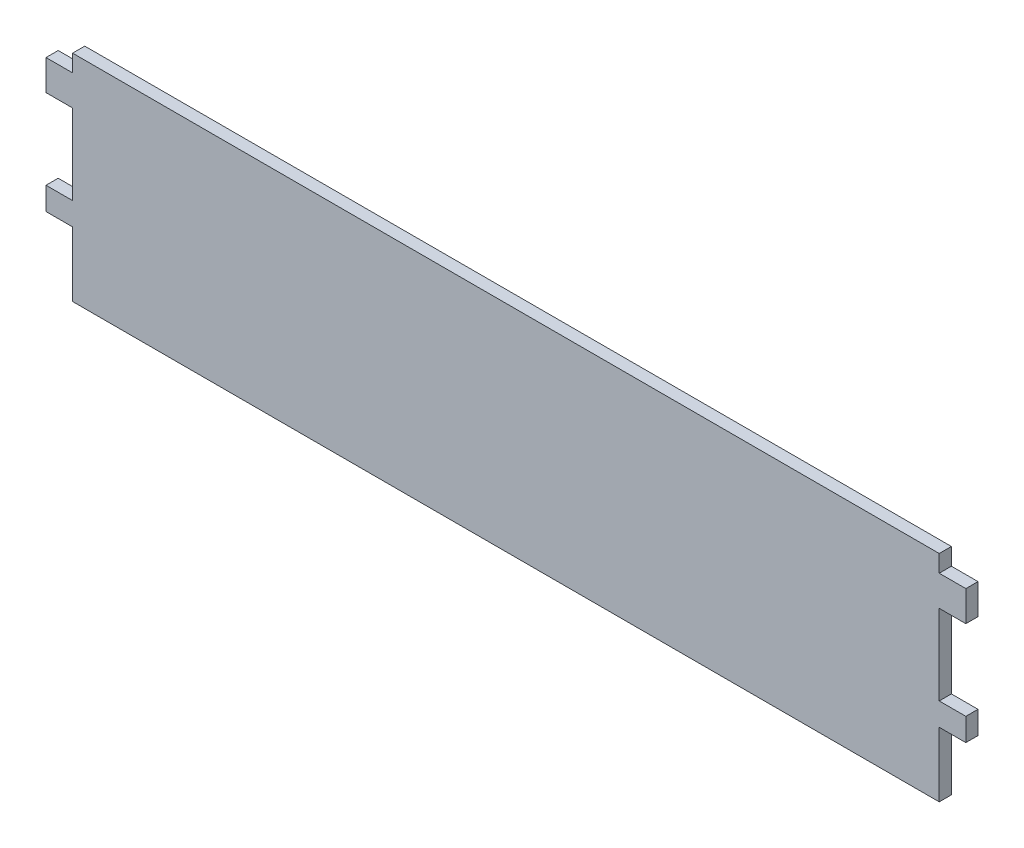
from build123d import *

# Parameters (mm, degrees)
EXTRUDE_531_DEPTH  = 1.6
SKETCH_3_W         = 114
SKETCH_3_H         = 2.25
SKETCH_3_H_2       = 8.5
EXTRUDE_1004_DEPTH = 1.6
LOGO_DEPTH         = 65.412828691
LOGO_DEPTH_BACK    = 1


with BuildPart() as part:
    # 草图1 → Extrude 531 (new body)
    with BuildSketch(Plane.XY):
        Polygon((60.5, 4), (-60.5, 4), (-60.5, 0), (-57, 0), (-57, -10.55), (-60.5, -10.55), (-60.5, -13.55), (-57, -13.55), (57, -13.55), (60.5, -13.55), (60.5, -10.55), (57, -10.55), (57, 0), (60.5, 0), align=None)
    extrude(amount=EXTRUDE_531_DEPTH)

    # 草图3 → Extrude 1004 (add)
    with BuildSketch(Plane(origin=(0, 0, 0), x_dir=(-1, 0, 0), z_dir=(0, 0, -1))):
        with Locations((0, 5.125)):
            Rectangle(SKETCH_3_W, SKETCH_3_H)
        with Locations((0, -17.8)):
            Rectangle(SKETCH_3_W, SKETCH_3_H_2)
    extrude(amount=-EXTRUDE_1004_DEPTH)

    # 草图4 → Logo (cut, two sides: drawn at the far end of the back side and taken through both)
    # profile 1 of 12: a face of its own
    with BuildSketch(Plane(origin=(0, 0, 0), x_dir=(-1, 0, 0), z_dir=(0, 0, -1)).offset(-LOGO_DEPTH_BACK)):
        with BuildLine():
            add(Edge.make_bspline(
                [(-38.107846783, -8.691409446), (-38.076628077, -8.61760206), (-38.022346486, -8.489269309), (-37.937573013, -8.336461356), (-37.876214667, -8.227875555), (-37.820659277, -8.202849847), (-37.801041279, -8.194012644)],
                knots=[0, 0, 0, 0, 1.60674543, 2.793732047, 3.574036608, 4, 4, 4, 4], degree=3))
            add(Edge.make_bspline(
                [(-37.801041279, -8.194012644), (-37.785580771, -8.194041602), (-37.758171606, -8.194092941), (-37.727555035, -8.226601594), (-37.732930225, -8.274028252), (-37.746435628, -8.303892645), (-37.754555597, -8.321848271)],
                knots=[0, 0, 0, 0, 1.002711623, 1.777657414, 2.663841829, 4, 4, 4, 4], degree=3))
            add(Edge.make_bspline(
                [(-37.754555597, -8.321848271), (-37.759584651, -8.344428762), (-37.772450144, -8.402194917), (-37.810406443, -8.504532144), (-37.863021956, -8.643498989), (-37.906779882, -8.747343643), (-37.93120119, -8.805299368)],
                knots=[0, 0, 0, 0, 0.538181526, 1.376793705, 2.53598797, 4, 4, 4, 4], degree=3))
            add(Edge.make_bspline(
                [(-37.93120119, -8.805299368), (-37.959605558, -8.867150481), (-38.009913819, -8.976697784), (-38.087788542, -9.110861267), (-38.142243367, -9.206952727), (-38.186920487, -9.241384332), (-38.203142432, -9.253886203)],
                knots=[0, 0, 0, 0, 1.540953334, 2.729252113, 3.538600455, 4, 4, 4, 4], degree=3))
            add(Edge.make_bspline(
                [(-38.203142432, -9.253886203), (-38.21582704, -9.251307634), (-38.253256162, -9.243698919), (-38.242676595, -9.20225756), (-38.23568241, -9.174860543)],
                knots=[0, 0, 0, 0, 0.677793528, 2, 2, 2, 2], degree=3))
            add(Edge.make_bspline(
                [(-38.23568241, -9.174860543), (-38.2342167, -9.146840518), (-38.230792504, -9.081380031), (-38.200989096, -8.973373407), (-38.162325666, -8.839645802), (-38.127132338, -8.743885199), (-38.107846783, -8.691409446)],
                knots=[0, 0, 0, 0, 0.669017828, 1.562961996, 2.664530091, 4, 4, 4, 4], degree=3))
        make_face()
    # profile 2 of 12: a face of its own
    with BuildSketch(Plane(origin=(0, 0, 0), x_dir=(-1, 0, 0), z_dir=(0, 0, -1)).offset(-LOGO_DEPTH_BACK)):
        with BuildLine():
            add(Edge.make_bspline(
                [(-37.175808851, -6.329936779), (-37.162211332, -6.33090674), (-37.136798566, -6.332719526), (-37.105695177, -6.3564884), (-37.088218983, -6.393885276), (-37.086578968, -6.443208148), (-37.091076101, -6.504952383), (-37.108875106, -6.579624515), (-37.13703413, -6.668063457), (-37.162178876, -6.730651435), (-37.175808851, -6.76457791)],
                knots=[0, 0, 0, 0, 0.642740851, 1.201235518, 1.784023804, 2.569454331, 3.540371604, 4.760000296, 6.24372395, 8, 8, 8, 8], degree=3))
            add(Edge.make_bspline(
                [(-37.175808851, -6.76457791), (-37.193227943, -6.803161079), (-37.23356422, -6.892505655), (-37.267878641, -6.984342025), (-37.287374489, -7.036519152)],
                knots=[0, 0, 0, 0, 0.863693597, 2, 2, 2, 2], degree=3))
            add(Edge.make_bspline(
                [(-37.287374489, -7.036519152), (-37.318644489, -7.107966767), (-37.37309707, -7.232383366), (-37.457711325, -7.380863407), (-37.519685021, -7.486295532), (-37.574589882, -7.511114733), (-37.594179993, -7.519970249)],
                knots=[0, 0, 0, 0, 1.597038354, 2.781031666, 3.565070854, 4, 4, 4, 4], degree=3))
            add(Edge.make_bspline(
                [(-37.594179993, -7.519970249), (-37.598877642, -7.511578791), (-37.614186926, -7.484231665), (-37.591032673, -7.417522477), (-37.564640835, -7.320530374), (-37.531986234, -7.24407191), (-37.512830048, -7.199219041)],
                knots=[0, 0, 0, 0, 0.331638533, 1.080784927, 2.287499295, 4, 4, 4, 4], degree=3))
            add(Edge.make_bspline(
                [(-37.512830048, -7.199219041), (-37.477942207, -7.106107549), (-37.408039158, -6.919544637), (-37.357050653, -6.681655958), (-37.319577579, -6.506215581), (-37.28083012, -6.413412768), (-37.237911303, -6.343918406), (-37.194876108, -6.334229545), (-37.175808851, -6.329936779)],
                knots=[0, 0, 0, 0, 1.861748334, 3.730293459, 4.569338651, 5.201093865, 5.646035096, 6, 6, 6, 6], degree=3))
        make_face()
    # profile 3 of 12: a face of its own
    with BuildSketch(Plane(origin=(0, 0, 0), x_dir=(-1, 0, 0), z_dir=(0, 0, -1)).offset(-LOGO_DEPTH_BACK)):
        with BuildLine():
            add(Edge.make_bspline(
                [(-31.311640015, -0.28912235), (-31.284683575, -0.262785183), (-31.226295073, -0.205738044), (-31.085455232, -0.182688239), (-30.914463241, -0.192499919), (-30.718799011, -0.240562084), (-30.527567145, -0.29914694), (-30.379055834, -0.372846653), (-30.274894305, -0.458129572), (-30.258932558, -0.530773873), (-30.251766456, -0.563387877)],
                knots=[0, 0, 0, 0, 0.723277834, 1.566642676, 2.676014656, 4.090742124, 5.497625369, 6.577509901, 7.361366311, 8, 8, 8, 8], degree=3))
            add(Edge.make_bspline(
                [(-30.251766456, -0.563387877), (-30.253355436, -0.583109249), (-30.256322301, -0.61993202), (-30.284771007, -0.670183235), (-30.334676114, -0.702328134), (-30.396143773, -0.719414294), (-30.462526346, -0.722236885), (-30.528065469, -0.706919895), (-30.583129058, -0.665584173), (-30.641137222, -0.599123442), (-30.697533326, -0.516293648), (-30.789452632, -0.489243534), (-30.846970049, -0.510924156), (-30.872838079, -0.549109692), (-30.893524935, -0.597714549), (-30.893361403, -0.636652021), (-30.893268873, -0.658683525)],
                knots=[0, 0, 0, 0, 0.895208026, 1.671488158, 2.534701377, 3.530408344, 4.556416936, 5.542661792, 6.533333546, 7.634570609, 9.585390954, 10.966188079, 11.616247868, 12.245789685, 13.007437048, 14, 14, 14, 14], degree=3))
            add(Edge.make_bspline(
                [(-30.893268873, -0.658683525), (-30.895596241, -0.682346452), (-30.900250977, -0.729672304), (-30.936687603, -0.79604816), (-30.994049259, -0.854619993), (-31.043515459, -0.884475732), (-31.069914466, -0.900409074)],
                knots=[0, 0, 0, 0, 0.900188895, 1.800377789, 2.826110695, 4, 4, 4, 4], degree=3))
            add(Edge.make_bspline(
                [(-31.069914466, -0.900409074), (-31.126152556, -0.940887123), (-31.256568926, -1.034755893), (-31.452753035, -1.19941603), (-31.655261224, -1.38056259), (-31.801444956, -1.535740738), (-31.896048503, -1.644496739), (-31.933998094, -1.705917255), (-31.962474351, -1.75058273), (-31.955570148, -1.7750379), (-31.953142432, -1.78363704)],
                knots=[0, 0, 0, 0, 1.309149496, 3.03592329, 4.839468888, 6.434563722, 7.079527317, 7.534408523, 7.836284672, 8, 8, 8, 8], degree=3))
            add(Edge.make_bspline(
                [(-31.953142432, -1.78363704), (-31.936144776, -1.789971402), (-31.889857682, -1.807220794), (-31.796149693, -1.767124736), (-31.670146161, -1.709798442), (-31.517476634, -1.61317757), (-31.353713127, -1.515649387), (-31.192663459, -1.439494551), (-31.046334277, -1.391275035), (-30.952430081, -1.384589527), (-30.909538862, -1.381535887)],
                knots=[0, 0, 0, 0, 0.371974414, 1.01294049, 2.005304349, 3.35093373, 4.783434642, 6.02412406, 7.097508622, 8, 8, 8, 8], degree=3))
            add(Edge.make_bspline(
                [(-30.909538862, -1.381535887), (-30.85510162, -1.38370671), (-30.743451677, -1.388159036), (-30.575650718, -1.428069782), (-30.404563617, -1.489550817), (-30.235054148, -1.570632083), (-30.079427405, -1.667715014), (-29.946654664, -1.770554235), (-29.846541051, -1.884072881), (-29.804668151, -1.968567736), (-29.784585348, -2.009092599)],
                knots=[0, 0, 0, 0, 0.969533767, 1.988498779, 3.059071882, 4.208400569, 5.331609509, 6.324100908, 7.196216367, 8, 8, 8, 8], degree=3))
            add(Edge.make_bspline(
                [(-29.784585348, -2.009092599), (-29.758524563, -2.095532312), (-29.701617044, -2.284286018), (-29.638392252, -2.599938562), (-29.589868515, -2.969735301), (-29.549505011, -3.379812228), (-29.521539921, -3.803059321), (-29.512717215, -4.214015455), (-29.51770801, -4.598773128), (-29.536251193, -4.846326842), (-29.545184083, -4.965582001)],
                knots=[0, 0, 0, 0, 0.726570842, 1.586573281, 2.587806203, 3.728594678, 4.903656754, 6.001764233, 7.037380935, 8, 8, 8, 8], degree=3))
            add(Edge.make_bspline(
                [(-29.545184083, -4.965582001), (-29.562098814, -5.082706058), (-29.593912197, -5.302994081), (-29.652219887, -5.611114963), (-29.724006212, -5.873497289), (-29.801332819, -6.092371525), (-29.88836713, -6.267809131), (-29.985794386, -6.39906432), (-30.094541916, -6.493005067), (-30.17916932, -6.513263381), (-30.219226478, -6.522852361)],
                knots=[0, 0, 0, 0, 1.593606111, 2.997269279, 4.219797478, 5.252909502, 6.120823443, 6.842838135, 7.452274168, 8, 8, 8, 8], degree=3))
            add(Edge.make_bspline(
                [(-30.219226478, -6.522852361), (-30.250240557, -6.528667069), (-30.305796981, -6.539083124), (-30.379076182, -6.557766448), (-30.429154569, -6.583389878), (-30.463935753, -6.611279638), (-30.469626135, -6.651896539), (-30.444466942, -6.688857172), (-30.404413648, -6.728105347), (-30.367839669, -6.751364473), (-30.347062105, -6.76457791)],
                knots=[0, 0, 0, 0, 1.627164147, 2.91478667, 3.860420201, 4.537361405, 5.101479074, 5.779594505, 6.738594543, 8, 8, 8, 8], degree=3))
            add(Edge.make_bspline(
                [(-30.347062105, -6.76457791), (-30.301088864, -6.787584246), (-30.193191104, -6.841579396), (-30.076825359, -6.873877219), (-30.010040907, -6.892413537)],
                knots=[0, 0, 0, 0, 0.852163029, 2, 2, 2, 2], degree=3))
            add(Edge.make_bspline(
                [(-30.010040907, -6.892413537), (-29.934473932, -6.917564982), (-29.790521191, -6.965477706), (-29.601537687, -7.077630967), (-29.44523974, -7.210691945), (-29.329076322, -7.374367796), (-29.245512499, -7.564830505), (-29.196978334, -7.785548911), (-29.17624165, -8.037283622), (-29.186471492, -8.214163399), (-29.191892897, -8.307902566)],
                knots=[0, 0, 0, 0, 1.055670002, 2.011018575, 2.901166229, 3.764162003, 4.653833133, 5.64784933, 6.753454748, 8, 8, 8, 8], degree=3))
            Line((-29.191892897, -8.307902566), (-29.287188546, -9.126050576))
            add(Edge.make_bspline(
                [(-29.287188546, -9.126050576), (-29.288939737, -9.163755036), (-29.292273873, -9.235541464), (-29.227605602, -9.31112429), (-29.148963252, -9.344723002), (-29.060080979, -9.368259202), (-28.943221959, -9.394512168), (-28.85500239, -9.407214864), (-28.806061733, -9.414261807)],
                knots=[0, 0, 0, 0, 1.040194204, 1.980450741, 2.591973454, 3.464355247, 4.593326626, 6, 6, 6, 6], degree=3))
            add(Edge.make_bspline(
                [(-28.806061733, -9.414261807), (-28.721473721, -9.42822664), (-28.548407204, -9.456798595), (-28.285289268, -9.515254124), (-28.013594539, -9.590672465), (-27.731723712, -9.678512716), (-27.442199204, -9.783675032), (-27.142956505, -9.9029342), (-26.835209024, -10.037039281), (-26.628693554, -10.135715752), (-26.523614727, -10.185924135)],
                knots=[0, 0, 0, 0, 0.850661014, 1.740446852, 2.673015819, 3.648097224, 4.669513319, 5.728853981, 6.844399605, 8, 8, 8, 8], degree=3))
            add(Edge.make_bspline(
                [(-26.523614727, -10.185924135), (-26.439578943, -10.237750399), (-26.261529196, -10.347556635), (-26.002233188, -10.557528012), (-25.724766679, -10.806006389), (-25.493579117, -11.043441722), (-25.311138689, -11.24232044), (-25.190586227, -11.386136446), (-25.088017283, -11.518562714), (-25.002178971, -11.639899833), (-24.937393796, -11.753108961), (-24.89016644, -11.855483817), (-24.858924855, -11.947476924), (-24.854503144, -12.006420042), (-24.852454444, -12.033730011)],
                knots=[0, 0, 0, 0, 1.396353778, 2.958506807, 4.713634611, 6.667988364, 7.646241715, 8.533721138, 9.323450595, 10.017090312, 10.636044742, 11.16612347, 11.613642055, 12, 12, 12, 12], degree=3))
            add(Edge.make_bspline(
                [(-24.852454444, -12.033730011), (-24.853780058, -12.076422829), (-24.856253056, -12.156068397), (-24.874194851, -12.265667482), (-24.903424305, -12.357290933), (-24.947638158, -12.429032312), (-25.005523031, -12.481251677), (-25.077718674, -12.509721969), (-25.161030551, -12.518560913), (-25.256127955, -12.504102741), (-25.36341637, -12.473667665), (-25.482264951, -12.420894622), (-25.61195782, -12.347878278), (-25.753867582, -12.255858212), (-25.910784441, -12.147381535), (-26.07640834, -12.012924164), (-26.257974937, -11.863025042), (-26.380648617, -11.753694501), (-26.444589067, -11.696708814)],
                knots=[0, 0, 0, 0, 0.934837225, 1.743985154, 2.42560997, 3.028288544, 3.569527049, 4.102182437, 4.70006254, 5.384218149, 6.195499161, 7.138160711, 8.224489256, 9.453276566, 10.842271881, 12.400816569, 14.124019716, 16, 16, 16, 16], degree=3))
            add(Edge.make_bspline(
                [(-26.444589067, -11.696708814), (-26.556736672, -11.594122945), (-26.768445406, -11.400464558), (-27.081190198, -11.144155983), (-27.367999772, -10.938144076), (-27.635412066, -10.771454869), (-27.907049128, -10.639419577), (-28.199384038, -10.52570924), (-28.522641447, -10.425941964), (-28.750671538, -10.373480713), (-28.868817404, -10.34629974)],
                knots=[0, 0, 0, 0, 1.294028113, 2.442825699, 3.440536503, 4.29928086, 5.12242041, 6.008132949, 6.967983324, 8, 8, 8, 8], degree=3))
            add(Edge.make_bspline(
                [(-28.868817404, -10.34629974), (-28.89462795, -10.343407848), (-28.955656033, -10.336570077), (-29.012601449, -10.313263568), (-29.045462997, -10.299814057)],
                knots=[0, 0, 0, 0, 0.845858004, 2, 2, 2, 2], degree=3))
            add(Edge.make_bspline(
                [(-29.045462997, -10.299814057), (-29.128173137, -10.283505672), (-29.276007621, -10.254356383), (-29.474888833, -10.225974818), (-29.623499761, -10.221199881), (-29.740479623, -10.235966785), (-29.835715218, -10.305179296), (-29.928772765, -10.41993822), (-30.048743174, -10.579710576), (-30.126789372, -10.708787823), (-30.170416512, -10.78094087)],
                knots=[0, 0, 0, 0, 1.449451699, 2.59072159, 3.443028246, 4.012341106, 4.570011633, 5.409321213, 6.551833303, 8, 8, 8, 8], degree=3))
            add(Edge.make_bspline(
                [(-30.170416512, -10.78094087), (-30.188870282, -10.808927739), (-30.220811575, -10.857369697), (-30.254015685, -10.904953683), (-30.268036445, -10.925046486)],
                knots=[0, 0, 0, 0, 1.155480481, 2, 2, 2, 2], degree=3))
            add(Edge.make_bspline(
                [(-30.268036445, -10.925046486), (-30.308281369, -10.983655373), (-30.390473625, -11.103352374), (-30.548775148, -11.264147124), (-30.731929165, -11.417511318), (-30.936053178, -11.55328045), (-31.140044028, -11.664105124), (-31.324881564, -11.741706084), (-31.488838627, -11.779315104), (-31.587401945, -11.767281509), (-31.632391224, -11.761788769)],
                knots=[0, 0, 0, 0, 1.022877387, 2.08902372, 3.238453135, 4.461709971, 5.615740045, 6.577817022, 7.350843829, 8, 8, 8, 8], degree=3))
            add(Edge.make_bspline(
                [(-31.632391224, -11.761788769), (-31.668683856, -11.756000751), (-31.734123535, -11.745564305), (-31.824499978, -11.746483163), (-31.897335244, -11.77429377), (-31.937913946, -11.826814994), (-31.986004955, -11.878931636), (-32.074631082, -11.886061363), (-32.182898794, -11.86990036), (-32.309094079, -11.827194808), (-32.431653663, -11.783319255), (-32.528972428, -11.74470991), (-32.591111554, -11.723157467), (-32.620969016, -11.715242664), (-32.629509111, -11.712978803)],
                knots=[0, 0, 0, 0, 1.237411736, 2.231191934, 3.026764953, 3.747205896, 4.449914613, 5.325870669, 6.563282404, 8.174237328, 9.785192251, 10.958958839, 11.702232199, 12, 12, 12, 12], degree=3))
            add(Edge.make_bspline(
                [(-32.629509111, -11.712978803), (-32.646694946, -11.714069902), (-32.68513102, -11.716510144), (-32.747536997, -11.692570222), (-32.821417551, -11.658296286), (-32.908233834, -11.605348272), (-33.006846963, -11.536408498), (-33.116227448, -11.44838341), (-33.240125557, -11.347008524), (-33.324077741, -11.270258966), (-33.368631462, -11.229527705)],
                knots=[0, 0, 0, 0, 0.455228246, 1.018116752, 1.749403562, 2.640129769, 3.725040215, 4.962772414, 6.388132618, 8, 8, 8, 8], degree=3))
            add(Edge.make_bspline(
                [(-33.368631462, -11.229527705), (-33.412215459, -11.191020013), (-33.494032272, -11.118732549), (-33.605925742, -11.013866409), (-33.710689712, -10.932660769), (-33.794090017, -10.858722312), (-33.86748893, -10.805333422), (-33.924642726, -10.765972933), (-33.966735748, -10.739932654), (-34.002497556, -10.728972475), (-34.037319456, -10.740557484), (-34.077148978, -10.761660928), (-34.130406054, -10.795605604), (-34.193592633, -10.845438584), (-34.273214855, -10.903974091), (-34.361280897, -10.980640717), (-34.463715261, -11.067871027), (-34.534836502, -11.132464793), (-34.572610636, -11.166772034)],
                knots=[0, 0, 0, 0, 1.823104747, 3.422371248, 4.802951973, 5.975158378, 6.912546107, 7.646720491, 8.146765455, 8.47075883, 8.771139406, 9.259852124, 9.893109979, 10.743061537, 11.78247626, 12.988896757, 14.400733498, 16, 16, 16, 16], degree=3))
            add(Edge.make_bspline(
                [(-34.572610636, -11.166772034), (-34.614875347, -11.205121553), (-34.695492639, -11.27827086), (-34.815235761, -11.37606362), (-34.928332595, -11.454716531), (-35.029441421, -11.522180812), (-35.125849254, -11.568670312), (-35.213668815, -11.601062443), (-35.294219145, -11.612166343), (-35.366853142, -11.612319937), (-35.431406663, -11.590364561), (-35.487003112, -11.551696797), (-35.532359141, -11.494903345), (-35.568427879, -11.421693565), (-35.59833984, -11.333451924), (-35.619258823, -11.228061867), (-35.62937546, -11.10654291), (-35.631412873, -11.019582404), (-35.632484195, -10.973856452)],
                knots=[0, 0, 0, 0, 1.636507142, 3.121534972, 4.428355836, 5.587033039, 6.600510396, 7.492778142, 8.256267449, 8.923136259, 9.555432383, 10.177894376, 10.840679899, 11.615718439, 12.507986185, 13.505757374, 14.68846646, 16, 16, 16, 16], degree=3))
            add(Edge.make_bspline(
                [(-35.632484195, -10.973856452), (-35.628874864, -10.948021142), (-35.620489323, -10.887998082), (-35.577405832, -10.792856507), (-35.506580384, -10.682822322), (-35.412590157, -10.553347788), (-35.286611913, -10.410351725), (-35.138646117, -10.246868131), (-34.961450659, -10.068961986), (-34.695987077, -9.815485389), (-34.371727735, -9.499418205), (-34.025386037, -9.124117544), (-33.737427059, -8.773094854), (-33.512646779, -8.442954301), (-33.333773891, -8.149243722), (-33.165105044, -7.916250727), (-33.024648699, -7.732376601), (-32.927202391, -7.63918372), (-32.885180364, -7.598995909)],
                knots=[0, 0, 0, 0, 0.284792247, 0.661656561, 1.13057987, 1.719885004, 2.4124502, 3.217785294, 4.136408919, 5.16324197, 7.240642594, 9.097503577, 10.757744405, 12.210898223, 13.471012291, 14.524187558, 15.363581539, 16, 16, 16, 16], degree=3))
            add(Edge.make_bspline(
                [(-32.885180364, -7.598995909), (-32.854703411, -7.569038139), (-32.799582563, -7.514856289), (-32.728584903, -7.438244636), (-32.678371541, -7.373425053), (-32.64868304, -7.320357428), (-32.637143739, -7.277315678), (-32.650532427, -7.239622927), (-32.69375408, -7.228934015), (-32.723559926, -7.229249403), (-32.741074749, -7.229434734)],
                knots=[0, 0, 0, 0, 1.917288756, 3.467622901, 4.684301768, 5.586112611, 6.186202145, 6.638111438, 7.199712828, 8, 8, 8, 8], degree=3))
            add(Edge.make_bspline(
                [(-32.741074749, -7.229434734), (-32.7951713, -7.239796548), (-32.917664481, -7.263259255), (-33.106505436, -7.355023701), (-33.327665728, -7.481182844), (-33.478846146, -7.588887641), (-33.561547044, -7.647805876)],
                knots=[0, 0, 0, 0, 0.708818721, 1.605009174, 2.689857492, 4, 4, 4, 4], degree=3))
            add(Edge.make_bspline(
                [(-33.561547044, -7.647805876), (-33.628785625, -7.692793796), (-33.770691741, -7.787740192), (-34.01509459, -7.904108287), (-34.295855553, -8.00872653), (-34.55092624, -8.079996061), (-34.759540445, -8.128398065), (-34.903456625, -8.157468029), (-35.032451409, -8.174092931), (-35.145048696, -8.18046165), (-35.242330583, -8.182439728), (-35.323608548, -8.172339993), (-35.389191011, -8.148923817), (-35.423655383, -8.125706919), (-35.439568613, -8.114986984)],
                knots=[0, 0, 0, 0, 1.456966556, 3.074908169, 4.86505158, 6.854699164, 7.844065629, 8.726155246, 9.500593981, 10.186308991, 10.75899819, 11.252842599, 11.655015127, 12, 12, 12, 12], degree=3))
            add(Edge.make_bspline(
                [(-35.439568613, -8.114986984), (-35.462946457, -8.088961574), (-35.510843746, -8.035639865), (-35.552751342, -7.930314449), (-35.581681158, -7.811352474), (-35.584510376, -7.725502135), (-35.585998512, -7.680345853)],
                knots=[0, 0, 0, 0, 0.885969566, 1.815203311, 2.850822311, 4, 4, 4, 4], degree=3))
            add(Edge.make_bspline(
                [(-35.585998512, -7.680345853), (-35.582936622, -7.648450174), (-35.577357549, -7.590333027), (-35.558565348, -7.512201998), (-35.535357696, -7.450756088), (-35.498065553, -7.403526387), (-35.440134739, -7.373733468), (-35.362602305, -7.345349426), (-35.257047933, -7.32748021), (-35.178470437, -7.316723509), (-35.135087393, -7.310784678)],
                knots=[0, 0, 0, 0, 1.144777775, 2.085900651, 2.868358293, 3.478741456, 4.186994201, 5.160219107, 6.432142221, 8, 8, 8, 8], degree=3))
            add(Edge.make_bspline(
                [(-35.135087393, -7.310784678), (-35.105529117, -7.306732406), (-35.041868723, -7.298004928), (-34.940540316, -7.270192321), (-34.824829859, -7.233467842), (-34.69528745, -7.183462459), (-34.549485439, -7.125887594), (-34.391494284, -7.053281498), (-34.217287863, -6.971701898), (-34.036199983, -6.879696254), (-33.858365918, -6.783783415), (-33.693531804, -6.697195728), (-33.551339131, -6.616265434), (-33.432094544, -6.540501416), (-33.331828795, -6.475365154), (-33.255632609, -6.41394851), (-33.196763789, -6.364324294), (-33.170602401, -6.328811291), (-33.159445891, -6.313666791)],
                knots=[0, 0, 0, 0, 0.6401933, 1.378800234, 2.252414814, 3.247682119, 4.360144783, 5.61893742, 6.981166277, 8.491930085, 9.980814333, 11.320908317, 12.491235582, 13.493158412, 14.356249053, 15.055370495, 15.597163258, 16, 16, 16, 16], degree=3))
            add(Edge.make_bspline(
                [(-33.159445891, -6.313666791), (-33.15293505, -6.295179216), (-33.137743089, -6.252041543), (-33.165186911, -6.171143155), (-33.226704134, -6.082860092), (-33.318668453, -5.981795041), (-33.416561431, -5.85793756), (-33.497598996, -5.705540197), (-33.557266963, -5.531159669), (-33.597831812, -5.340736648), (-33.618943604, -5.141971785), (-33.616058767, -4.944021721), (-33.59373051, -4.750421489), (-33.561466544, -4.625942306), (-33.545277055, -4.563480848)],
                knots=[0, 0, 0, 0, 0.366940885, 0.856195397, 1.543319608, 2.437843703, 3.464305549, 4.559316956, 5.722715607, 6.982448179, 8.279780118, 9.540647387, 10.765940243, 12, 12, 12, 12], degree=3))
            add(Edge.make_bspline(
                [(-33.545277055, -4.563480848), (-33.525958858, -4.49237837), (-33.482572541, -4.332690868), (-33.428442339, -4.061732172), (-33.37577754, -3.733586977), (-33.327405004, -3.3653366), (-33.27429291, -2.994512099), (-33.198983646, -2.660139781), (-33.11641246, -2.375425752), (-33.036015806, -2.212019855), (-32.999070286, -2.136928226)],
                knots=[0, 0, 0, 0, 0.708092258, 1.590288938, 2.654253427, 3.902334637, 5.161036124, 6.252355818, 7.196886704, 8, 8, 8, 8], degree=3))
            add(Edge.make_bspline(
                [(-32.999070286, -2.136928226), (-32.978066596, -2.096262345), (-32.939156359, -2.020927057), (-32.897962535, -1.912083765), (-32.870906024, -1.820651076), (-32.858679568, -1.74495296), (-32.866821993, -1.683687866), (-32.893045403, -1.636206775), (-32.942325245, -1.611475046), (-32.978678663, -1.608602651), (-32.999070286, -1.606991447)],
                knots=[0, 0, 0, 0, 1.714583763, 3.176339847, 4.353251578, 5.289894348, 6.025231198, 6.637916301, 7.235970086, 8, 8, 8, 8], degree=3))
            add(Edge.make_bspline(
                [(-32.999070286, -1.606991447), (-33.009280966, -1.608905273), (-33.035581637, -1.613834907), (-33.078150972, -1.637525481), (-33.135427637, -1.669167414), (-33.201201988, -1.720329409), (-33.28359848, -1.779994592), (-33.378287695, -1.854300388), (-33.485412472, -1.943342261), (-33.638687796, -2.074075205), (-33.825046944, -2.228329224), (-34.039825964, -2.375496669), (-34.226970372, -2.483562375), (-34.394650514, -2.539048509), (-34.535554713, -2.569523351), (-34.652828437, -2.597576564), (-34.749702993, -2.623075363), (-34.826168586, -2.654305446), (-34.900417712, -2.667858844), (-34.977114512, -2.644374824), (-35.057068142, -2.595456265), (-35.107286605, -2.548663643), (-35.135087393, -2.52275939)],
                knots=[0, 0, 0, 0, 0.249250516, 0.642019514, 1.161100016, 1.830013696, 2.644562526, 3.61621218, 4.730894377, 6.003474266, 8.474744691, 10.557863463, 12.279965477, 13.662442066, 14.795293296, 15.755924724, 16.571971871, 17.204134486, 17.751045257, 18.349164808, 19.086102656, 20, 20, 20, 20], degree=3))
            add(Edge.make_bspline(
                [(-35.135087393, -2.52275939), (-35.164716845, -2.49383366), (-35.218779368, -2.441055161), (-35.312020171, -2.393219284), (-35.400578466, -2.372576895), (-35.485282007, -2.390076645), (-35.557941387, -2.44285225), (-35.614666979, -2.528509249), (-35.657237526, -2.643774608), (-35.672792431, -2.732345424), (-35.681294161, -2.780754927)],
                knots=[0, 0, 0, 0, 1.172958171, 2.140204258, 2.949550661, 3.715617781, 4.523759799, 5.442192297, 6.601997723, 8, 8, 8, 8], degree=3))
            add(Edge.make_bspline(
                [(-35.681294161, -2.780754927), (-35.695011238, -2.845878345), (-35.7208887, -2.968734612), (-35.760756938, -3.141044774), (-35.807263611, -3.287397475), (-35.859529097, -3.420221563), (-35.920289956, -3.567606418), (-35.982759866, -3.75986519), (-36.056352031, -4.007711865), (-36.125686484, -4.242378355), (-36.181148755, -4.440477318), (-36.220807743, -4.577032443), (-36.257619587, -4.693934699), (-36.290370419, -4.793272809), (-36.319423318, -4.873418892), (-36.345978376, -4.934014469), (-36.364461253, -4.978258546), (-36.396422689, -5.014615812), (-36.44318895, -5.072757797), (-36.500664151, -5.184396955), (-36.586789724, -5.344458172), (-36.645172867, -5.47181875), (-36.678412049, -5.544328747)],
                knots=[0, 0, 0, 0, 1.352381641, 2.551287499, 3.591835473, 4.468900799, 5.451131009, 6.83009741, 8.5731734, 10.705325127, 11.801656784, 12.753128586, 13.594574499, 14.291520485, 14.879283795, 15.323710602, 15.640520394, 15.842121546, 16.301896809, 17.155187448, 18.380367374, 20, 20, 20, 20], degree=3))
            add(Edge.make_bspline(
                [(-36.678412049, -5.544328747), (-36.703074467, -5.597067152), (-36.749016871, -5.695310926), (-36.815084953, -5.83175604), (-36.880512242, -5.942565342), (-36.938507497, -6.03231711), (-36.990862908, -6.101050477), (-37.038852173, -6.146060163), (-37.084279114, -6.173675195), (-37.113581031, -6.170853348), (-37.126998884, -6.169561175)],
                knots=[0, 0, 0, 0, 1.750226533, 3.260410724, 4.55456355, 5.613883533, 6.475883408, 7.135412723, 7.604090575, 8, 8, 8, 8], degree=3))
            add(Edge.make_bspline(
                [(-37.126998884, -6.169561175), (-37.141294673, -6.157291422), (-37.179060877, -6.124877541), (-37.177055268, -6.07359556), (-37.175808851, -6.041725549)],
                knots=[0, 0, 0, 0, 0.757067819, 2, 2, 2, 2], degree=3))
            add(Edge.make_bspline(
                [(-37.175808851, -6.041725549), (-37.168357472, -5.965870945), (-37.152893696, -5.808450596), (-37.047663923, -5.625011555), (-36.944575471, -5.456914788), (-36.866953456, -5.27481097), (-36.777416778, -5.049308198), (-36.691239053, -4.786958294), (-36.605269922, -4.516762683), (-36.511306128, -4.269294344), (-36.43453236, -4.049575761), (-36.345830896, -3.854099322), (-36.26076269, -3.647477595), (-36.181218527, -3.399233912), (-36.098129702, -3.099813368), (-36.046208204, -2.881672699), (-36.018315359, -2.764484939)],
                knots=[0, 0, 0, 0, 0.908071408, 1.884512109, 2.4990433, 3.288218855, 4.260236297, 5.422757743, 6.61182259, 7.674420958, 8.61030002, 9.41276662, 10.258286118, 11.299825281, 12.54943404, 14, 14, 14, 14], degree=3))
            add(Edge.make_bspline(
                [(-36.018315359, -2.764484939), (-35.995975437, -2.683159317), (-35.956309952, -2.538762208), (-35.902864641, -2.349669622), (-35.856235381, -2.220292109), (-35.821576738, -2.13293189), (-35.765964528, -2.089012949), (-35.6950252, -2.074491979), (-35.605974887, -2.082611406), (-35.540898916, -2.096597399), (-35.504648568, -2.104388248)],
                knots=[0, 0, 0, 0, 2.042120642, 3.62587226, 4.740642462, 5.394637589, 5.848451737, 6.38951958, 7.102887384, 8, 8, 8, 8], degree=3))
            add(Edge.make_bspline(
                [(-35.504648568, -2.104388248), (-35.473720074, -2.109296057), (-35.407490133, -2.119805584), (-35.299037797, -2.113799753), (-35.174560405, -2.10364681), (-35.035272305, -2.076262341), (-34.879397128, -2.041062517), (-34.707623861, -1.994980422), (-34.520883322, -1.933364724), (-34.323830124, -1.865854684), (-34.131242954, -1.794724057), (-33.955975989, -1.722720732), (-33.805144724, -1.65286586), (-33.676522133, -1.588380262), (-33.570946828, -1.527179496), (-33.491900518, -1.466012352), (-33.431480076, -1.411483721), (-33.40885559, -1.369772197), (-33.398847155, -1.351320193)],
                knots=[0, 0, 0, 0, 0.654573022, 1.401695579, 2.266128589, 3.272620062, 4.371655169, 5.616377019, 6.997749201, 8.492082541, 9.982086648, 11.299864739, 12.46232564, 13.464485275, 14.316630054, 15.011645016, 15.562779594, 16, 16, 16, 16], degree=3))
            add(Edge.make_bspline(
                [(-33.398847155, -1.351320193), (-33.391702949, -1.338433113), (-33.373300901, -1.305238569), (-33.317857745, -1.262536362), (-33.24305137, -1.205082974), (-33.141603952, -1.139526468), (-33.014995464, -1.064912054), (-32.862998337, -0.981998571), (-32.687666681, -0.885726386), (-32.491500332, -0.789040055), (-32.296833474, -0.68943817), (-32.114215411, -0.604622929), (-31.956331858, -0.528925119), (-31.820258709, -0.468588277), (-31.705567244, -0.422770956), (-31.612693348, -0.394579305), (-31.543647736, -0.370921327), (-31.503878463, -0.370598765), (-31.488285608, -0.370472295)],
                knots=[0, 0, 0, 0, 0.323826308, 0.834111849, 1.520622249, 2.425052479, 3.502348958, 4.777600929, 6.259672584, 7.932931663, 9.621523978, 11.103198082, 12.393034021, 13.499599562, 14.401583839, 15.123440629, 15.656315999, 16, 16, 16, 16], degree=3))
            add(Edge.make_bspline(
                [(-31.488285608, -0.370472295), (-31.46899437, -0.374176917), (-31.432417935, -0.381200929), (-31.379327949, -0.370044747), (-31.336307792, -0.337600825), (-31.320419282, -0.30637585), (-31.311640015, -0.28912235)],
                knots=[0, 0, 0, 0, 1.089560711, 2.065821164, 2.931260839, 4, 4, 4, 4], degree=3))
        make_face()
        with BuildLine():
            add(Edge.make_bspline(
                [(-32.452863518, -5.72097434), (-32.435552842, -5.729336741), (-32.40422439, -5.744470818), (-32.352976178, -5.746559424), (-32.310763328, -5.720897147), (-32.281602488, -5.680298941), (-32.261571196, -5.633233602), (-32.262246638, -5.583104799), (-32.291109808, -5.542359918), (-32.330312562, -5.509910909), (-32.377684627, -5.489005202), (-32.427719155, -5.483474981), (-32.471724509, -5.509449043), (-32.502825403, -5.549840649), (-32.526315046, -5.596873955), (-32.524210699, -5.64762906), (-32.497129004, -5.69139406), (-32.46858976, -5.710465326), (-32.452863518, -5.72097434)],
                knots=[0, 0, 0, 0, 1.152113668, 2.085068047, 2.941406334, 4.005137989, 5.053415093, 5.987534937, 6.867682337, 7.960673332, 9.026448661, 9.960568504, 10.857855293, 11.950846288, 13.016621617, 13.950741461, 14.870778289, 16, 16, 16, 16], degree=3))
        make_face(mode=Mode.SUBTRACT)
        with BuildLine():
            add(Edge.make_bspline(
                [(-30.63759762, -2.427463741), (-30.654375051, -2.39447375), (-30.686246932, -2.331803065), (-30.775973846, -2.270383608), (-30.887211749, -2.255950469), (-31.01504951, -2.28465897), (-31.161159262, -2.350825455), (-31.329199604, -2.452765924), (-31.516668127, -2.593881298), (-31.644731446, -2.704744094), (-31.713741168, -2.764484939)],
                knots=[0, 0, 0, 0, 0.674940831, 1.282176888, 1.919678005, 2.691420749, 3.672168229, 4.872139927, 6.314484153, 8, 8, 8, 8], degree=3))
            add(Edge.make_bspline(
                [(-31.713741168, -2.764484939), (-31.774102493, -2.81980403), (-31.880106, -2.916952622), (-32.028163719, -3.030256241), (-32.135075426, -3.107971722), (-32.217432838, -3.135357638), (-32.275489894, -3.138044605), (-32.315259389, -3.167567611), (-32.335182368, -3.2146352), (-32.344751501, -3.262765551), (-32.326216439, -3.311106631), (-32.275633329, -3.333003969), (-32.207840352, -3.357442544), (-32.10973536, -3.372517045), (-31.985547263, -3.390758342), (-31.833032869, -3.396871317), (-31.653412541, -3.405297648), (-31.524720772, -3.405746685), (-31.45574563, -3.405987356)],
                knots=[0, 0, 0, 0, 2.23291849, 3.921338534, 5.100901541, 5.810142713, 6.262382619, 6.65588633, 7.08162029, 7.635296762, 7.957518455, 8.40378136, 9.05272293, 9.957202743, 11.088148812, 12.486933467, 14.117095896, 16, 16, 16, 16], degree=3))
            Line((-31.45574563, -3.405987356), (-30.572517665, -3.405987356))
            Line((-30.572517665, -3.405987356), (-30.572517665, -3.006210487))
            add(Edge.make_bspline(
                [(-30.572517665, -3.006210487), (-30.573524107, -2.944208363), (-30.575400611, -2.828605934), (-30.585807221, -2.66936416), (-30.605079648, -2.537482845), (-30.627572465, -2.461382173), (-30.63759762, -2.427463741)],
                knots=[0, 0, 0, 0, 1.272603768, 2.372758803, 3.27473084, 4, 4, 4, 4], degree=3))
        make_face(mode=Mode.SUBTRACT)
        with BuildLine():
            add(Edge.make_bspline(
                [(-30.588787653, -4.258999628), (-30.588361933, -4.230392055), (-30.587590203, -4.178533301), (-30.60308973, -4.10506872), (-30.649335595, -4.055165745), (-30.712336921, -4.028048207), (-30.789302955, -4.028536901), (-30.87960468, -4.051269116), (-30.979751698, -4.105266746), (-31.048715742, -4.152167909), (-31.086184455, -4.177649684)],
                knots=[0, 0, 0, 0, 0.989902763, 1.794459253, 2.514076454, 3.244545246, 4.10078263, 5.11917762, 6.434826304, 8, 8, 8, 8], degree=3))
            add(Edge.make_bspline(
                [(-31.086184455, -4.177649684), (-31.12400393, -4.202753025), (-31.207562257, -4.258216335), (-31.369323546, -4.305267943), (-31.567709661, -4.334502625), (-31.791151799, -4.338090041), (-32.011123087, -4.341123474), (-32.197586516, -4.370201993), (-32.343484482, -4.414988706), (-32.408383771, -4.473129045), (-32.436593529, -4.498400893)],
                knots=[0, 0, 0, 0, 0.765457562, 1.691201526, 2.820012914, 4.160045992, 5.47384466, 6.537819334, 7.364434283, 8, 8, 8, 8], degree=3))
            add(Edge.make_bspline(
                [(-32.436593529, -4.498400893), (-32.458833553, -4.527721223), (-32.497703274, -4.578965458), (-32.533184706, -4.657789489), (-32.533853874, -4.730105408), (-32.493614957, -4.786471248), (-32.426590825, -4.816567421), (-32.342434188, -4.830812892), (-32.24064409, -4.817773915), (-32.169039286, -4.799147022), (-32.129788025, -4.788936408)],
                knots=[0, 0, 0, 0, 1.273183384, 2.225190126, 2.950395699, 3.665094117, 4.481433163, 5.434574371, 6.593722988, 8, 8, 8, 8], degree=3))
            add(Edge.make_bspline(
                [(-32.129788025, -4.788936408), (-32.075109684, -4.769221505), (-31.954427008, -4.725707981), (-31.747830664, -4.681037192), (-31.503323946, -4.633025417), (-31.325761533, -4.608960182), (-31.230290071, -4.596020826)],
                knots=[0, 0, 0, 0, 0.755861966, 1.668292106, 2.746291174, 4, 4, 4, 4], degree=3))
            add(Edge.make_bspline(
                [(-31.230290071, -4.596020826), (-31.171338373, -4.587945449), (-31.06480284, -4.573351899), (-30.922875737, -4.547912552), (-30.814936464, -4.524300374), (-30.736299764, -4.496312527), (-30.678433498, -4.458150922), (-30.63644499, -4.405239444), (-30.605790088, -4.337255643), (-30.594744579, -4.286417185), (-30.588787653, -4.258999628)],
                knots=[0, 0, 0, 0, 1.799585912, 3.252151332, 4.360534732, 5.139535991, 5.763529596, 6.429665283, 7.153106871, 8, 8, 8, 8], degree=3))
        make_face(mode=Mode.SUBTRACT)
        with BuildLine():
            add(Edge.make_bspline(
                [(-30.460952027, -8.210282633), (-30.45141206, -8.161966177), (-30.434966569, -8.07867576), (-30.434357305, -7.964190711), (-30.488501969, -7.884446518), (-30.564734321, -7.868901928), (-30.632636225, -7.880506551), (-30.701871916, -7.896293268), (-30.781992768, -7.928113802), (-30.876257372, -7.969949905), (-30.981671669, -8.027310023), (-31.103559263, -8.090731964), (-31.235492333, -8.171445992), (-31.32794931, -8.228825273), (-31.37671997, -8.259092599)],
                knots=[0, 0, 0, 0, 1.353937618, 2.333988017, 3.047172328, 3.793689255, 4.307061923, 4.94027491, 5.732751052, 6.663767479, 7.765033749, 9.018587752, 10.427317761, 12, 12, 12, 12], degree=3))
            add(Edge.make_bspline(
                [(-31.37671997, -8.259092599), (-31.440414271, -8.300641684), (-31.556671483, -8.376478624), (-31.712567907, -8.483541498), (-31.826536751, -8.582104807), (-31.90834023, -8.662415477), (-31.956191693, -8.728438649), (-31.968388349, -8.793529852), (-31.923481569, -8.841247476), (-31.882188243, -8.849339357), (-31.857846783, -8.854109334)],
                knots=[0, 0, 0, 0, 1.951915585, 3.562709128, 4.845719058, 5.815787134, 6.494342794, 6.933512551, 7.371330321, 8, 8, 8, 8], degree=3))
            add(Edge.make_bspline(
                [(-31.857846783, -8.854109334), (-31.83619308, -8.857622725), (-31.783113519, -8.866235072), (-31.729319835, -8.86737823), (-31.697471179, -8.868055039)],
                knots=[0, 0, 0, 0, 0.815896095, 2, 2, 2, 2], degree=3))
            add(Edge.make_bspline(
                [(-31.697471179, -8.868055039), (-31.584978352, -8.869820885), (-31.359377143, -8.87336224), (-31.135615083, -8.90233773), (-31.023428784, -8.916865006)],
                knots=[0, 0, 0, 0, 0.997271483, 2, 2, 2, 2], degree=3))
            add(Edge.make_bspline(
                [(-31.023428784, -8.916865006), (-30.984150578, -8.925111597), (-30.913017817, -8.940046159), (-30.813323741, -8.943306879), (-30.732858327, -8.919939558), (-30.666506588, -8.868164979), (-30.622015697, -8.770442079), (-30.573155215, -8.631830291), (-30.513984733, -8.439747731), (-30.479991175, -8.292662362), (-30.460952027, -8.210282633)],
                knots=[0, 0, 0, 0, 0.904828088, 1.638642062, 2.224402238, 2.759220813, 3.478751981, 4.595305524, 6.093095123, 8, 8, 8, 8], degree=3))
        make_face(mode=Mode.SUBTRACT)
        with BuildLine():
            add(Edge.make_bspline(
                [(-31.183804388, -9.848902938), (-31.191072021, -9.840490385), (-31.208462294, -9.820360501), (-31.254494516, -9.804723333), (-31.313925362, -9.788741443), (-31.391028953, -9.774847906), (-31.485049223, -9.766683572), (-31.595902093, -9.759744647), (-31.724555176, -9.755400739), (-31.913636517, -9.752085693), (-32.14802468, -9.757562521), (-32.411070883, -9.778036703), (-32.644119524, -9.810042388), (-32.786279774, -9.847627937), (-32.852640387, -9.865172927)],
                knots=[0, 0, 0, 0, 0.232574372, 0.556512987, 0.999321398, 1.550919953, 2.212020531, 3.002944387, 3.908044242, 4.94424072, 7.016959909, 8.881185315, 10.544132732, 12, 12, 12, 12], degree=3))
            add(Edge.make_bspline(
                [(-32.852640387, -9.865172927), (-32.903524385, -9.880954502), (-32.994866559, -9.909284103), (-33.111985298, -9.964320845), (-33.197839811, -10.027350857), (-33.22600383, -10.08248954), (-33.238471551, -10.106898475)],
                knots=[0, 0, 0, 0, 1.357408503, 2.436692252, 3.307950867, 4, 4, 4, 4], degree=3))
            add(Edge.make_bspline(
                [(-33.238471551, -10.106898475), (-33.247812518, -10.140020529), (-33.268520445, -10.213448583), (-33.244478759, -10.342512404), (-33.185397799, -10.488950292), (-33.097225446, -10.647924427), (-32.992763181, -10.797139243), (-32.887329244, -10.915594242), (-32.78379457, -10.996696591), (-32.709429201, -11.014611803), (-32.675994794, -11.022666419)],
                knots=[0, 0, 0, 0, 0.707130232, 1.56763219, 2.652776992, 3.992626532, 5.332379384, 6.425967169, 7.292320398, 8, 8, 8, 8], degree=3))
            add(Edge.make_bspline(
                [(-32.675994794, -11.022666419), (-32.638875982, -11.027839632), (-32.563230663, -11.038382248), (-32.444604775, -11.029626932), (-32.321649328, -11.003191901), (-32.192103956, -10.960774662), (-32.058096208, -10.899475122), (-31.917430736, -10.821877171), (-31.771232764, -10.726535841), (-31.625810292, -10.615434308), (-31.487465642, -10.501063403), (-31.369245954, -10.389150126), (-31.276521529, -10.282053219), (-31.205436302, -10.184826149), (-31.161109411, -10.090803003), (-31.140352239, -10.00352466), (-31.145766405, -9.919219328), (-31.17113963, -9.872314801), (-31.183804388, -9.848902938)],
                knots=[0, 0, 0, 0, 0.848406905, 1.728988859, 2.680586289, 3.697951831, 4.815355602, 6.019170093, 7.340598608, 8.771616837, 10.169422179, 11.412766154, 12.45962666, 13.381363234, 14.136486124, 14.801977674, 15.402020728, 16, 16, 16, 16], degree=3))
        make_face(mode=Mode.SUBTRACT)
    # profile 4 of 12: a face of its own
    with BuildSketch(Plane(origin=(0, 0, 0), x_dir=(-1, 0, 0), z_dir=(0, 0, -1)).offset(-LOGO_DEPTH_BACK)):
        with BuildLine():
            add(Edge.make_bspline(
                [(-30.844458907, 1.042692451), (-30.712086254, 1.063590135), (-30.460961738, 1.103235188), (-30.10364482, 1.147849132), (-29.786490796, 1.175581576), (-29.509812494, 1.191984575), (-29.271729251, 1.188620237), (-29.07475565, 1.167513784), (-28.913507894, 1.138924813), (-28.827887401, 1.094845092), (-28.789791744, 1.075232428)],
                knots=[0, 0, 0, 0, 1.546054891, 2.933024915, 4.153387382, 5.218423116, 6.130327976, 6.894349726, 7.508056162, 8, 8, 8, 8], degree=3))
            add(Edge.make_bspline(
                [(-28.789791744, 1.075232428), (-28.77982901, 1.067505578), (-28.757547382, 1.050224496), (-28.756338804, 0.997356637), (-28.762784759, 0.93304296), (-28.799169197, 0.827580022), (-28.855929079, 0.692846217), (-28.9416472, 0.61508452), (-28.982707326, 0.577835627)],
                knots=[0, 0, 0, 0, 0.375996528, 0.840915228, 1.521547827, 2.431379554, 4.29058309, 6, 6, 6, 6], degree=3))
            add(Edge.make_bspline(
                [(-28.982707326, 0.577835627), (-28.999597303, 0.571071043), (-29.047208445, 0.552002365), (-29.147707997, 0.541101726), (-29.293001023, 0.52652873), (-29.486263675, 0.51609788), (-29.725624855, 0.507111796), (-30.011553879, 0.499649503), (-30.344739889, 0.499126041), (-30.710425081, 0.496130642), (-31.07923067, 0.495140107), (-31.422587265, 0.48943692), (-31.725449195, 0.474107158), (-31.989184014, 0.459969247), (-32.211806546, 0.437115697), (-32.394790699, 0.40922753), (-32.538984606, 0.380222927), (-32.672685005, 0.330173628), (-32.799384791, 0.2674971), (-32.934322996, 0.216572523), (-33.049269985, 0.18247186), (-33.144725119, 0.175733832), (-33.219807493, 0.172698852), (-33.277198843, 0.154053126), (-33.313381176, 0.113537572), (-33.317615534, 0.081078791), (-33.319821495, 0.064168836)],
                knots=[0, 0, 0, 0, 0.29378639, 0.828154207, 1.622377561, 2.665910303, 3.959527744, 5.503628527, 7.298312766, 9.356539971, 11.427316877, 13.272541108, 14.918305791, 16.33916657, 17.550478886, 18.540890432, 19.338576626, 19.926149405, 20.847437553, 21.625938105, 22.262159038, 22.779149242, 23.170014671, 23.47997514, 23.729084189, 24, 24, 24, 24], degree=3))
            add(Edge.make_bspline(
                [(-33.319821495, 0.064168836), (-33.327148291, 0.041067019), (-33.346243759, -0.01914211), (-33.428544741, -0.108708642), (-33.55487124, -0.217039243), (-33.715616094, -0.343388658), (-33.889402192, -0.464589987), (-34.054884076, -0.558898271), (-34.196482516, -0.631472499), (-34.289273652, -0.650258911), (-34.330885087, -0.658683525)],
                knots=[0, 0, 0, 0, 0.452899868, 1.180370635, 2.23536444, 3.608270401, 5.02587573, 6.223068022, 7.203149215, 8, 8, 8, 8], degree=3))
            Line((-34.330885087, -0.658683525), (-34.605150614, -0.723763481))
            add(Edge.make_bspline(
                [(-34.605150614, -0.723763481), (-34.623736269, -0.724497969), (-34.667189884, -0.726215217), (-34.741960589, -0.73029324), (-34.839016225, -0.764065505), (-34.91749971, -0.827153386), (-34.995994548, -0.878266998), (-35.069658049, -0.89749386), (-35.1496974, -0.893958746), (-35.228549187, -0.871189277), (-35.298229366, -0.848766263), (-35.358589795, -0.841940273), (-35.40224, -0.871037459), (-35.405363425, -0.900807552), (-35.407028635, -0.916679063)],
                knots=[0, 0, 0, 0, 0.753349001, 1.761344217, 3.020923456, 4.830179237, 5.814476835, 6.788225392, 7.855005698, 9.018797465, 10.091554178, 10.84425008, 11.383827995, 12, 12, 12, 12], degree=3))
            add(Edge.make_bspline(
                [(-35.407028635, -0.916679063), (-35.408312104, -0.934288463), (-35.410778872, -0.968132928), (-35.445175818, -1.010145392), (-35.500187583, -1.027543056), (-35.570264762, -1.027531468), (-35.659684211, -1.012457833), (-35.767473559, -0.977589147), (-35.896534235, -0.932140394), (-35.98612732, -0.890429293), (-36.034585348, -0.867869096)],
                knots=[0, 0, 0, 0, 0.578089017, 1.111060756, 1.692033027, 2.442213511, 3.436795462, 4.704643656, 6.217647404, 8, 8, 8, 8], degree=3))
            add(Edge.make_bspline(
                [(-36.034585348, -0.867869096), (-36.072798962, -0.848956008), (-36.143065784, -0.814178806), (-36.236421903, -0.759866961), (-36.311320073, -0.713412374), (-36.363840928, -0.667996988), (-36.399017575, -0.629612162), (-36.415181084, -0.590440248), (-36.404191791, -0.551835312), (-36.383019919, -0.538198992), (-36.371606545, -0.530847899)],
                knots=[0, 0, 0, 0, 1.849681631, 3.401176532, 4.688184792, 5.665626522, 6.406140722, 6.937798934, 7.427386582, 8, 8, 8, 8], degree=3))
            add(Edge.make_bspline(
                [(-36.371606545, -0.530847899), (-36.34553692, -0.520886783), (-36.283653706, -0.497241416), (-36.217168093, -0.497916963), (-36.178690963, -0.498307921)],
                knots=[0, 0, 0, 0, 0.842542684, 2, 2, 2, 2], degree=3))
            add(Edge.make_bspline(
                [(-36.178690963, -0.498307921), (-36.107554581, -0.492816352), (-35.950026674, -0.480655551), (-35.752841094, -0.405157378), (-35.566579287, -0.336880233), (-35.394448057, -0.277707089), (-35.193514066, -0.22133083), (-35.050657087, -0.182127766), (-34.974711789, -0.161286724)],
                knots=[0, 0, 0, 0, 1.01966247, 2.25799077, 3.004052601, 3.872944221, 4.8692195, 6, 6, 6, 6], degree=3))
            add(Edge.make_bspline(
                [(-34.974711789, -0.161286724), (-34.817867168, -0.118286955), (-34.499375533, -0.030970815), (-34.021401523, 0.123692754), (-33.533929953, 0.297231124), (-33.210089308, 0.429356763), (-33.045555969, 0.496485682)],
                knots=[0, 0, 0, 0, 0.956660942, 1.942613692, 2.95470614, 4, 4, 4, 4], degree=3))
            add(Edge.make_bspline(
                [(-33.045555969, 0.496485682), (-32.979140553, 0.523385406), (-32.840498646, 0.579538468), (-32.619546597, 0.655866268), (-32.376510864, 0.727534938), (-32.112039131, 0.796599802), (-31.826330031, 0.86451174), (-31.518317098, 0.926460437), (-31.18899416, 0.986934505), (-30.9615207, 1.023747727), (-30.844458907, 1.042692451)],
                knots=[0, 0, 0, 0, 0.756481224, 1.579151453, 2.466882982, 3.431176416, 4.464929373, 5.567073804, 6.747973917, 8, 8, 8, 8], degree=3))
        make_face()
    # profile 5 of 12: a face of its own
    with BuildSketch(Plane(origin=(0, 0, 0), x_dir=(-1, 0, 0), z_dir=(0, 0, -1)).offset(-LOGO_DEPTH_BACK)):
        with BuildLine():
            add(Edge.make_bspline(
                [(-14.806898475, -3.808088509), (-14.805655367, -3.786406006), (-14.803502205, -3.748850201), (-14.787563058, -3.698349011), (-14.747171034, -3.672028946), (-14.695896626, -3.679394777), (-14.636968885, -3.705211014), (-14.56431707, -3.751019583), (-14.47885818, -3.818865394), (-14.420557091, -3.874915398), (-14.388527334, -3.905708442)],
                knots=[0, 0, 0, 0, 0.890250096, 1.541983379, 2.068140339, 2.701204345, 3.552429479, 4.701882333, 6.18806288, 8, 8, 8, 8], degree=3))
            add(Edge.make_bspline(
                [(-14.388527334, -3.905708442), (-14.357323333, -3.934929295), (-14.28972443, -3.998232001), (-14.185726061, -4.105142845), (-14.071869442, -4.230814901), (-13.994654802, -4.32227513), (-13.953886203, -4.370565266)],
                knots=[0, 0, 0, 0, 0.8054175, 1.744819223, 2.809285893, 4, 4, 4, 4], degree=3))
            add(Edge.make_bspline(
                [(-13.953886203, -4.370565266), (-13.904395256, -4.42488072), (-13.812078845, -4.526196376), (-13.681488249, -4.666813075), (-13.567410797, -4.784336671), (-13.473150625, -4.883286232), (-13.393713818, -4.957471203), (-13.331104341, -5.013102768), (-13.286190869, -5.043663039), (-13.252205948, -5.065876394), (-13.221715304, -5.049612033), (-13.202985283, -5.014890317), (-13.177956991, -4.963981539), (-13.154737589, -4.892297044), (-13.125216098, -4.800782178), (-13.100085077, -4.688199555), (-13.067504583, -4.556416977), (-13.041579917, -4.41046332), (-13.009821204, -4.2656864), (-12.979127636, -4.135727811), (-12.954020522, -4.025753616), (-12.922400909, -3.941074887), (-12.89756764, -3.874891933), (-12.873701533, -3.832353156), (-12.849839529, -3.802170419), (-12.813907113, -3.806031181), (-12.795207004, -3.852289065), (-12.784885306, -3.922956173), (-12.772977968, -4.035195937), (-12.767353516, -4.185196796), (-12.766065371, -4.375254862), (-12.764652723, -4.603803103), (-12.773963082, -4.872623358), (-12.784744632, -5.277165018), (-12.807969868, -5.793327157), (-12.845279614, -6.394553458), (-12.888641343, -6.961067473), (-12.925113397, -7.326340075), (-12.942822611, -7.50370026)],
                knots=[0, 0, 0, 0, 1.309407171, 2.442462273, 3.418848929, 4.229146626, 4.873728722, 5.363383856, 5.700417395, 5.879888007, 6.015855741, 6.253373369, 6.574479519, 7.028592192, 7.591914708, 8.28837103, 9.082033279, 10.010698718, 10.928630167, 11.722292416, 12.391962588, 12.933374939, 13.33586898, 13.638960308, 13.824693395, 13.963436267, 14.193204443, 14.615569436, 15.281815622, 16.180123934, 17.298449117, 18.665186855, 20.253351621, 22.09030425, 25.876618502, 29.459041575, 32.824000504, 36, 36, 36, 36], degree=3))
            add(Edge.make_bspline(
                [(-12.942822611, -7.50370026), (-12.980761374, -7.886141096), (-13.055988764, -8.644469079), (-13.076674663, -9.406232809), (-13.086928226, -9.783822983)],
                knots=[0, 0, 0, 0, 1.008642289, 2, 2, 2, 2], degree=3))
            add(Edge.make_bspline(
                [(-13.086928226, -9.783822983), (-13.089406178, -9.889992923), (-13.093911942, -10.083046161), (-13.108399316, -10.344882373), (-13.123154732, -10.550524659), (-13.141796744, -10.705607004), (-13.162973879, -10.822525798), (-13.199108489, -10.909360974), (-13.239244099, -10.979363515), (-13.278031768, -11.008898026), (-13.296113797, -11.022666419)],
                knots=[0, 0, 0, 0, 1.981598951, 3.60322415, 4.893965801, 5.826482955, 6.521222676, 7.098459891, 7.579720199, 8, 8, 8, 8], degree=3))
            add(Edge.make_bspline(
                [(-13.296113797, -11.022666419), (-13.337869011, -11.042445371), (-13.418552841, -11.080664349), (-13.55323254, -11.091990211), (-13.685706656, -11.06239688), (-13.815427296, -10.989541634), (-13.942650305, -10.877901171), (-14.067909804, -10.726410313), (-14.190461546, -10.535389823), (-14.266440334, -10.392627823), (-14.307177389, -10.316084046)],
                knots=[0, 0, 0, 0, 0.794022563, 1.534294147, 2.288868916, 3.110471425, 4.080217474, 5.202654832, 6.500165553, 8, 8, 8, 8], degree=3))
            add(Edge.make_bspline(
                [(-14.307177389, -10.316084046), (-14.332059402, -10.267318263), (-14.37867394, -10.175959316), (-14.442875313, -10.046877695), (-14.502854547, -9.938389502), (-14.556178471, -9.850126172), (-14.601991238, -9.780020472), (-14.644422228, -9.733827102), (-14.675162672, -9.696839276), (-14.699559975, -9.690895151), (-14.709278542, -9.688527334)],
                knots=[0, 0, 0, 0, 1.738552152, 3.257043865, 4.578582452, 5.67145743, 6.538205395, 7.218720324, 7.688780406, 8, 8, 8, 8], degree=3))
            add(Edge.make_bspline(
                [(-14.709278542, -9.688527334), (-14.727258289, -9.675164997), (-14.773452776, -9.640833799), (-14.767830052, -9.52634181), (-14.748029644, -9.394278183), (-14.711526526, -9.265141908), (-14.678491632, -9.162597696), (-14.646833254, -9.10252003), (-14.619968414, -9.054268255), (-14.592984024, -9.03779883), (-14.581442916, -9.030754927)],
                knots=[0, 0, 0, 0, 0.708735342, 1.820919117, 3.405074647, 5.293366206, 6.219691318, 6.9665185, 7.55798438, 8, 8, 8, 8], degree=3))
            add(Edge.make_bspline(
                [(-14.581442916, -9.030754927), (-14.563277682, -9.013754172), (-14.515759676, -8.969282298), (-14.469078317, -8.852599737), (-14.410796379, -8.689138373), (-14.375830159, -8.558617046), (-14.355987356, -8.484548159)],
                knots=[0, 0, 0, 0, 0.494809184, 1.294359625, 2.464589859, 4, 4, 4, 4], degree=3))
            add(Edge.make_bspline(
                [(-14.355987356, -8.484548159), (-14.346563887, -8.445187346), (-14.325691308, -8.358004839), (-14.313196775, -8.211193672), (-14.300279242, -8.037752491), (-14.29684074, -7.836839758), (-14.299379047, -7.60744953), (-14.308979363, -7.350934084), (-14.325506385, -7.06656051), (-14.3564791, -6.660413245), (-14.401657279, -6.159160758), (-14.47312111, -5.592378759), (-14.557148654, -5.081797343), (-14.628861396, -4.763089845), (-14.66279286, -4.612290814)],
                knots=[0, 0, 0, 0, 0.372861889, 0.825873048, 1.355932712, 1.977857566, 2.678268019, 3.472063673, 4.34539184, 5.30570904, 7.229332797, 8.987138439, 10.574440178, 12, 12, 12, 12], degree=3))
            add(Edge.make_bspline(
                [(-14.66279286, -4.612290814), (-14.684466289, -4.519467378), (-14.723729529, -4.351309915), (-14.766410896, -4.123880015), (-14.798665894, -3.949164394), (-14.804497626, -3.849230151), (-14.806898475, -3.808088509)],
                knots=[0, 0, 0, 0, 1.398007235, 2.532607705, 3.395893465, 4, 4, 4, 4], degree=3))
        make_face()
    # profile 6 of 12: a face of its own
    with BuildSketch(Plane(origin=(0, 0, 0), x_dir=(-1, 0, 0), z_dir=(0, 0, -1)).offset(-LOGO_DEPTH_BACK)):
        with BuildLine():
            add(Edge.make_bspline(
                [(-11.994514689, -0.337932317), (-11.977574632, -0.31561599), (-11.942587379, -0.269524823), (-11.851715458, -0.239929542), (-11.744660194, -0.23078898), (-11.614576696, -0.254596278), (-11.46061111, -0.295662073), (-11.285010164, -0.368828869), (-11.083157012, -0.461406443), (-10.944198455, -0.538337002), (-10.869561175, -0.579657865)],
                knots=[0, 0, 0, 0, 0.535243935, 1.105469427, 1.788863319, 2.62959719, 3.664435544, 4.900405045, 6.335148703, 8, 8, 8, 8], degree=3))
            add(Edge.make_bspline(
                [(-10.869561175, -0.579657865), (-10.778343336, -0.629890747), (-10.612644374, -0.721139743), (-10.375441757, -0.815126167), (-10.174974818, -0.868222851), (-10.055443736, -0.856695118), (-10.002603198, -0.851599107)],
                knots=[0, 0, 0, 0, 1.349524295, 2.451436867, 3.315434048, 4, 4, 4, 4], degree=3))
            add(Edge.make_bspline(
                [(-10.002603198, -0.851599107), (-9.965071546, -0.842872179), (-9.901468789, -0.828083148), (-9.826973208, -0.820280907), (-9.766302011, -0.82913924), (-9.762475413, -0.856461091), (-9.76087765, -0.867869096)],
                knots=[0, 0, 0, 0, 1.69561439, 2.873461326, 3.529623381, 4, 4, 4, 4], degree=3))
            add(Edge.make_bspline(
                [(-9.76087765, -0.867869096), (-9.764388664, -0.88537942), (-9.772213536, -0.924404048), (-9.815654457, -0.980665476), (-9.884210147, -1.035962506), (-9.939479941, -1.072890645), (-9.970063221, -1.093324656)],
                knots=[0, 0, 0, 0, 0.668019817, 1.488791762, 2.610434786, 4, 4, 4, 4], degree=3))
            add(Edge.make_bspline(
                [(-9.970063221, -1.093324656), (-10.001556815, -1.115105022), (-10.06173937, -1.156726122), (-10.129722974, -1.241579056), (-10.171352844, -1.340096669), (-10.179070269, -1.445787551), (-10.187571961, -1.552778178), (-10.244128141, -1.64860554), (-10.335650446, -1.725431943), (-10.4624776, -1.779036372), (-10.611468849, -1.853517708), (-10.775537438, -1.972838088), (-10.957161093, -2.135099738), (-11.143686231, -2.33374371), (-11.338754873, -2.531391621), (-11.542390819, -2.691643128), (-11.741994142, -2.810474828), (-11.880444592, -2.85504292), (-11.945704723, -2.876050576)],
                knots=[0, 0, 0, 0, 0.662628557, 1.266247307, 1.863978426, 2.48871062, 3.102016502, 3.705034038, 4.363819646, 5.146764374, 6.086375257, 7.255840244, 8.658290712, 10.31534101, 11.991435361, 13.478493816, 14.811460539, 16, 16, 16, 16], degree=3))
            add(Edge.make_bspline(
                [(-11.945704723, -2.876050576), (-12.04637464, -2.885760759), (-12.24645934, -2.90506006), (-12.491783024, -2.866545484), (-12.662164357, -2.806644041), (-12.75830606, -2.750303484), (-12.819197081, -2.67380876), (-12.82733524, -2.615795569), (-12.831256973, -2.587839345)],
                knots=[0, 0, 0, 0, 1.786802728, 3.551327895, 4.34166401, 4.977462403, 5.507245016, 6, 6, 6, 6], degree=3))
            add(Edge.make_bspline(
                [(-12.831256973, -2.587839345), (-12.834039866, -2.548482464), (-12.839341168, -2.473509151), (-12.927453164, -2.428665513), (-12.993262632, -2.379385338), (-13.03583132, -2.299782657), (-13.073380583, -2.190928604), (-13.09253246, -2.105485926), (-13.103198215, -2.057902566)],
                knots=[0, 0, 0, 0, 1.065751042, 2.030213903, 2.639027305, 3.458318904, 4.584527897, 6, 6, 6, 6], degree=3))
            add(Edge.make_bspline(
                [(-13.103198215, -2.057902566), (-13.113639483, -2.02501769), (-13.131695446, -1.968150257), (-13.14152816, -1.891518956), (-13.154827256, -1.84800929), (-13.148561493, -1.810421141), (-13.113631535, -1.81765935), (-13.074992724, -1.828927724), (-13.014365899, -1.859079199), (-12.968891931, -1.883517164), (-12.942822611, -1.897526962)],
                knots=[0, 0, 0, 0, 1.77033949, 3.061427478, 3.863409368, 4.239614021, 4.636168544, 5.338864949, 6.47442429, 8, 8, 8, 8], degree=3))
            add(Edge.make_bspline(
                [(-12.942822611, -1.897526962), (-12.894604888, -1.917486808), (-12.788938833, -1.961227535), (-12.601664817, -1.982389664), (-12.381798429, -1.989757768), (-12.139896734, -1.972684899), (-11.902786187, -1.939233675), (-11.70053587, -1.887737213), (-11.539498737, -1.822369245), (-11.465457854, -1.752443731), (-11.432037932, -1.720881369)],
                knots=[0, 0, 0, 0, 0.789130035, 1.729327981, 2.835920593, 4.132828427, 5.40581715, 6.464650797, 7.306987613, 8, 8, 8, 8], degree=3))
            add(Edge.make_bspline(
                [(-11.432037932, -1.720881369), (-11.411265559, -1.703671278), (-11.373483423, -1.672368452), (-11.332098921, -1.623364536), (-11.307429295, -1.577399158), (-11.31162729, -1.53010072), (-11.338178818, -1.480799765), (-11.377647197, -1.415064626), (-11.43934863, -1.332529527), (-11.486932137, -1.271411183), (-11.513387877, -1.237430271)],
                knots=[0, 0, 0, 0, 1.090891524, 1.984184099, 2.603202996, 3.138367183, 3.827591485, 4.857000352, 6.252537814, 8, 8, 8, 8], degree=3))
            add(Edge.make_bspline(
                [(-11.513387877, -1.237430271), (-11.561504872, -1.184683945), (-11.652053496, -1.08542365), (-11.766499132, -0.935318452), (-11.864722025, -0.803513453), (-11.936235051, -0.68328612), (-11.987748513, -0.577943147), (-12.015073961, -0.485706655), (-12.021854672, -0.403787796), (-12.00307139, -0.358543362), (-11.994514689, -0.337932317)],
                knots=[0, 0, 0, 0, 1.613194871, 3.035779205, 4.265654727, 5.32606686, 6.195896564, 6.905677409, 7.50148273, 8, 8, 8, 8], degree=3))
        make_face()
    # profile 7 of 12: a face of its own
    with BuildSketch(Plane(origin=(0, 0, 0), x_dir=(-1, 0, 0), z_dir=(0, 0, -1)).offset(-LOGO_DEPTH_BACK)):
        with BuildLine():
            add(Edge.make_bspline(
                [(-7.094923763, 0.159464485), (-7.062855723, 0.19041838), (-7.002020357, 0.249140134), (-6.894117121, 0.310700725), (-6.778586519, 0.336876029), (-6.649412762, 0.329868358), (-6.492295723, 0.28460946), (-6.286246545, 0.212866233), (-6.026167478, 0.099951717), (-5.834269826, 0.014024461), (-5.728244701, -0.033451097)],
                knots=[0, 0, 0, 0, 0.717544078, 1.361232438, 1.976988351, 2.60269372, 3.427585854, 4.606027558, 6.124800637, 8, 8, 8, 8], degree=3))
            add(Edge.make_bspline(
                [(-5.728244701, -0.033451097), (-5.638613797, -0.081294133), (-5.465478305, -0.17371011), (-5.245240205, -0.363720211), (-5.080134565, -0.592184811), (-4.982224148, -0.811623554), (-4.929212142, -1.016262427), (-4.889851137, -1.206226456), (-4.856457863, -1.433004787), (-4.823481115, -1.694826359), (-4.797075029, -1.992640417), (-4.77073884, -2.324939762), (-4.750801808, -2.693110902), (-4.739416497, -2.950418405), (-4.733451097, -3.085236147)],
                knots=[0, 0, 0, 0, 1.07513603, 2.076785982, 3.052907645, 4.042251139, 4.604296093, 5.292314481, 6.098716204, 7.034195945, 8.090425409, 9.268750898, 10.568946354, 12, 12, 12, 12], degree=3))
            add(Edge.make_bspline(
                [(-4.733451097, -3.085236147), (-4.729825041, -3.227799681), (-4.722729849, -3.506757204), (-4.708176632, -3.915017209), (-4.69409339, -4.303164791), (-4.681278818, -4.671260399), (-4.663184139, -5.019758023), (-4.650841208, -5.349171141), (-4.634866367, -5.658347769), (-4.614490434, -5.947128743), (-4.600189368, -6.216201725), (-4.580607705, -6.465567177), (-4.562191583, -6.694907659), (-4.544364487, -6.905034648), (-4.523062306, -7.094760181), (-4.502128674, -7.265213663), (-4.481830779, -7.415637675), (-4.466358718, -7.509154168), (-4.459185571, -7.552510227)],
                knots=[0, 0, 0, 0, 1.5285695, 2.990988994, 4.37871482, 5.691752182, 6.938764442, 8.119038236, 9.225049131, 10.256932773, 11.221992903, 12.11304138, 12.937854622, 13.688195449, 14.373243673, 14.984053073, 15.528987308, 16, 16, 16, 16], degree=3))
            add(Edge.make_bspline(
                [(-4.459185571, -7.552510227), (-4.448737174, -7.619086306), (-4.426547506, -7.760476517), (-4.399405169, -7.986109586), (-4.374064753, -8.236416302), (-4.350969708, -8.51073259), (-4.330333849, -8.809055412), (-4.310985526, -9.131315255), (-4.298905273, -9.478572533), (-4.283839472, -9.838746702), (-4.27564624, -10.188996612), (-4.269612443, -10.506639058), (-4.272033979, -10.780274745), (-4.279070154, -11.010239296), (-4.287840027, -11.1970973), (-4.308100247, -11.338026168), (-4.323631886, -11.440526398), (-4.352812257, -11.486384315), (-4.363889922, -11.503793232)],
                knots=[0, 0, 0, 0, 0.814360348, 1.729488765, 2.745917528, 3.854704475, 5.056119393, 6.359721506, 7.75592992, 9.255052979, 10.716151397, 11.989648663, 13.094515034, 14.021871398, 14.77236798, 15.34839797, 15.752634081, 16, 16, 16, 16], degree=3))
            add(Edge.make_bspline(
                [(-4.363889922, -11.503793232), (-4.393356031, -11.534281379), (-4.450151418, -11.593046725), (-4.559406225, -11.649992738), (-4.681897034, -11.665459351), (-4.816532387, -11.643230506), (-4.970326968, -11.582729882), (-5.146945837, -11.478660106), (-5.358777655, -11.341176195), (-5.504444346, -11.228446714), (-5.584139085, -11.166772034)],
                knots=[0, 0, 0, 0, 0.720209397, 1.388190431, 2.055517286, 2.790137102, 3.69358914, 4.859291442, 6.281707727, 8, 8, 8, 8], degree=3))
            add(Edge.make_bspline(
                [(-5.584139085, -11.166772034), (-5.711243869, -11.073102919), (-5.974918829, -10.878789222), (-6.415660827, -10.621453548), (-6.903766112, -10.37419972), (-7.251957367, -10.228631514), (-7.431944961, -10.153384158)],
                knots=[0, 0, 0, 0, 0.895776503, 1.858260776, 2.892888648, 4, 4, 4, 4], degree=3))
            add(Edge.make_bspline(
                [(-7.431944961, -10.153384158), (-7.457517184, -10.144455897), (-7.493473662, -10.131902088), (-7.540651327, -10.076337455), (-7.466422291, -10.057672377), (-7.427182282, -10.057916031), (-7.399404983, -10.058088509)],
                knots=[0, 0, 0, 0, 1.372902042, 1.930404043, 2.534970088, 4, 4, 4, 4], degree=3))
            add(Edge.make_bspline(
                [(-7.399404983, -10.058088509), (-7.371506334, -10.060318629), (-7.308717807, -10.065337724), (-7.203574992, -10.076157496), (-7.076259833, -10.08101659), (-6.984115436, -10.08726648), (-6.934548159, -10.090628486)],
                knots=[0, 0, 0, 0, 0.72066214, 1.621917692, 2.720757133, 4, 4, 4, 4], degree=3))
            add(Edge.make_bspline(
                [(-6.934548159, -10.090628486), (-6.862519388, -10.095480771), (-6.726299581, -10.104657345), (-6.53398424, -10.102794111), (-6.365222962, -10.0988977), (-6.221116914, -10.078753482), (-6.098972744, -10.056581638), (-6.002849765, -10.01900834), (-5.927924743, -9.975481533), (-5.874576632, -9.91232873), (-5.846033377, -9.821273927), (-5.826523577, -9.697919745), (-5.817519789, -9.533683035), (-5.811746342, -9.329029794), (-5.821581087, -9.084103989), (-5.834587921, -8.798121542), (-5.858501038, -8.470349909), (-5.879701304, -8.238137703), (-5.890944589, -8.114986984)],
                knots=[0, 0, 0, 0, 1.189178743, 2.248958259, 3.169082749, 3.96728823, 4.645939482, 5.207895387, 5.661309435, 6.060207875, 6.53693385, 7.210763362, 8.119566925, 9.243478735, 10.584710771, 12.157094843, 13.96196531, 16, 16, 16, 16], degree=3))
            add(Edge.make_bspline(
                [(-5.890944589, -8.114986984), (-5.91474908, -7.82914387), (-5.961440736, -7.268472862), (-6.020688692, -6.44158028), (-6.076299682, -5.645117248), (-6.129105969, -4.879067053), (-6.169438969, -4.142845265), (-6.207575983, -3.437120525), (-6.238056467, -2.760734035), (-6.253138405, -2.31978632), (-6.260505764, -2.104388248)],
                knots=[0, 0, 0, 0, 1.143024747, 2.242002009, 3.303583521, 4.324700707, 5.301913624, 6.241794804, 7.14113625, 8, 8, 8, 8], degree=3))
            add(Edge.make_bspline(
                [(-6.260505764, -2.104388248), (-6.263454411, -2.026130185), (-6.268972814, -1.87966994), (-6.27892744, -1.674392701), (-6.286161212, -1.497497828), (-6.300883163, -1.349559499), (-6.314818247, -1.230394479), (-6.327025858, -1.139540982), (-6.342296301, -1.078135181), (-6.359446246, -1.03772772), (-6.391089259, -1.021697174), (-6.429806343, -1.031381062), (-6.476834436, -1.052484172), (-6.535378842, -1.089046838), (-6.605660792, -1.13796838), (-6.685918896, -1.203898536), (-6.779805727, -1.282700148), (-6.910233587, -1.404443514), (-7.066268832, -1.543533755), (-7.236136614, -1.673087689), (-7.373609743, -1.759934586), (-7.461542157, -1.776822412), (-7.497024916, -1.78363704)],
                knots=[0, 0, 0, 0, 1.907728306, 3.57032031, 5.006699497, 6.219906709, 7.189098867, 7.933829355, 8.442016682, 8.746344394, 8.957357695, 9.242967142, 9.674178388, 10.224433758, 10.91557883, 11.761529026, 12.752348271, 13.901315216, 16.108235945, 17.833287434, 19.125681464, 20, 20, 20, 20], degree=3))
            add(Edge.make_bspline(
                [(-7.497024916, -1.78363704), (-7.525370304, -1.77621594), (-7.600601928, -1.756519565), (-7.724975921, -1.675098801), (-7.89134413, -1.551851368), (-8.050260199, -1.419020652), (-8.186572887, -1.301943134), (-8.278257908, -1.215999491), (-8.357697956, -1.141364817), (-8.424618455, -1.077749998), (-8.471611137, -1.018070228), (-8.511189688, -0.973012596), (-8.533724087, -0.933911488), (-8.538686369, -0.909832865), (-8.540628486, -0.900409074)],
                knots=[0, 0, 0, 0, 0.756098406, 2.006764276, 3.802524319, 6.142866242, 7.367288597, 8.461745075, 9.399569727, 10.194934637, 10.850735524, 11.365188066, 11.751549936, 12, 12, 12, 12], degree=3))
            add(Edge.make_bspline(
                [(-8.540628486, -0.900409074), (-8.536318305, -0.88277548), (-8.526741462, -0.843595182), (-8.459112798, -0.809392902), (-8.367891834, -0.791071943), (-8.24465909, -0.791630419), (-8.098822072, -0.771371728), (-7.943743621, -0.701275149), (-7.788082024, -0.586921206), (-7.692337667, -0.488298707), (-7.641130532, -0.43555225)],
                knots=[0, 0, 0, 0, 0.394435141, 0.876400234, 1.578924237, 2.528200993, 3.647829007, 4.890068773, 6.336709604, 8, 8, 8, 8], degree=3))
            Line((-7.641130532, -0.43555225), (-7.094923763, 0.159464485))
        make_face()
    # profile 8 of 12: a face of its own
    with BuildSketch(Plane(origin=(0, 0, 0), x_dir=(-1, 0, 0), z_dir=(0, 0, -1)).offset(-LOGO_DEPTH_BACK)):
        with BuildLine():
            add(Edge.make_bspline(
                [(9.170416512, -0.805113425), (9.198293699, -0.77298816), (9.256023084, -0.70646166), (9.39989312, -0.670378144), (9.5693874, -0.682740705), (9.773904931, -0.740807534), (10.012828564, -0.844345844), (10.29064036, -0.989662819), (10.602920857, -1.184689749), (10.820499764, -1.334141293), (10.936872443, -1.414075865)],
                knots=[0, 0, 0, 0, 0.500737434, 1.036950498, 1.698872516, 2.537077087, 3.576722643, 4.826572087, 6.302683314, 8, 8, 8, 8], degree=3))
            add(Edge.make_bspline(
                [(10.936872443, -1.414075865), (11.005260973, -1.453431704), (11.14590881, -1.534370914), (11.353849699, -1.591889799), (11.553777469, -1.617373667), (11.754880301, -1.629507224), (12.003619834, -1.639300766), (12.18577239, -1.639450106), (12.284957233, -1.639531424)],
                knots=[0, 0, 0, 0, 1.020927553, 2.099639404, 2.769418161, 3.636259283, 4.71290715, 6, 6, 6, 6], degree=3))
            add(Edge.make_bspline(
                [(12.284957233, -1.639531424), (12.394187907, -1.639741639), (12.590236504, -1.640118935), (12.850947838, -1.647871895), (13.043826481, -1.663820445), (13.182495701, -1.68162782), (13.283316038, -1.719270716), (13.37145379, -1.76504161), (13.451083235, -1.833051966), (13.498860098, -1.886103096), (13.523800669, -1.913796951)],
                knots=[0, 0, 0, 0, 1.990309998, 3.572233614, 4.747964258, 5.520705446, 6.105597656, 6.699280647, 7.320995946, 8, 8, 8, 8], degree=3))
            add(Edge.make_bspline(
                [(13.523800669, -1.913796951), (13.556993246, -1.957502028), (13.619705644, -2.040076221), (13.699100211, -2.164689497), (13.763375942, -2.279200769), (13.805476662, -2.387637346), (13.831774249, -2.485718722), (13.844042789, -2.576344328), (13.831355636, -2.659014278), (13.80316425, -2.734456389), (13.755108852, -2.799939824), (13.690076059, -2.858238856), (13.604462641, -2.902278732), (13.504733547, -2.943304323), (13.384950011, -2.968497772), (13.249706376, -2.993499803), (13.094694254, -3.00292355), (12.986110602, -3.005074758), (12.928783935, -3.006210487)],
                knots=[0, 0, 0, 0, 1.416675233, 2.67659545, 3.813582377, 4.801945112, 5.670659723, 6.435195612, 7.142614181, 7.807738134, 8.4962276, 9.219041849, 10.043055436, 10.968233441, 11.997083708, 13.194440575, 14.518806736, 16, 16, 16, 16], degree=3))
            add(Edge.make_bspline(
                [(12.928783935, -3.006210487), (12.866014827, -3.007219788), (12.748879177, -3.009103281), (12.584938755, -3.019651094), (12.445787058, -3.040025484), (12.324887784, -3.068780136), (12.210523794, -3.110752412), (12.092844953, -3.173954803), (11.959378684, -3.25005606), (11.868524227, -3.310836687), (11.820100409, -3.343231685)],
                knots=[0, 0, 0, 0, 1.271877942, 2.373496359, 3.325877921, 4.117780877, 4.887594532, 5.786194277, 6.820080729, 8, 8, 8, 8], degree=3))
            add(Edge.make_bspline(
                [(11.820100409, -3.343231685), (11.722284038, -3.415014225), (11.543388927, -3.546296395), (11.302875283, -3.728450501), (11.118989802, -3.881224925), (10.984906545, -4.004160925), (10.894243217, -4.108976063), (10.839139333, -4.202038986), (10.809464313, -4.290318959), (10.818660242, -4.344907507), (10.822982521, -4.370565266)],
                knots=[0, 0, 0, 0, 1.964418846, 3.592700527, 4.88398239, 5.833425605, 6.536886417, 7.115671613, 7.584347158, 8, 8, 8, 8], degree=3))
            add(Edge.make_bspline(
                [(10.822982521, -4.370565266), (10.835284202, -4.399048757), (10.857184605, -4.449757272), (10.896980478, -4.509227678), (10.932599075, -4.5543406), (10.972473417, -4.562494368), (11.007610709, -4.570549386), (11.045355233, -4.594868592), (11.094890436, -4.632313081), (11.161336253, -4.680203899), (11.236870915, -4.746922963), (11.327848834, -4.825552586), (11.432340343, -4.918661518), (11.678344941, -5.142150301), (12.083214285, -5.488293698), (12.575860611, -5.846678715), (12.99356092, -6.144671718), (13.301747626, -6.416575405), (13.612279519, -6.717571866), (13.808782349, -6.939097443), (13.909631833, -7.052789141)],
                knots=[0, 0, 0, 0, 0.404832366, 0.720713909, 0.95080276, 1.121259333, 1.237199059, 1.423869496, 1.700484959, 2.056385492, 2.496463314, 3.022583276, 3.634813265, 4.33319606, 7.385076746, 10.61870329, 12.327056111, 14.114935407, 16.006101171, 18, 18, 18, 18], degree=3))
            add(Edge.make_bspline(
                [(13.909631833, -7.052789141), (13.974704988, -7.126348532), (14.108763065, -7.277889218), (14.331619866, -7.497981992), (14.575319063, -7.723316945), (14.791943757, -7.908986736), (14.968911442, -8.048336867), (15.089801128, -8.142352531), (15.199132772, -8.22134942), (15.295353784, -8.286882457), (15.380825282, -8.335823916), (15.451569396, -8.374440783), (15.512071992, -8.397178628), (15.548914112, -8.401406917), (15.564522127, -8.403198215)],
                knots=[0, 0, 0, 0, 1.639586836, 3.377734763, 5.227109097, 7.18186069, 8.139580368, 8.988339115, 9.738821781, 10.391873901, 10.931071613, 11.382400801, 11.738356599, 12, 12, 12, 12], degree=3))
            add(Edge.make_bspline(
                [(15.564522127, -8.403198215), (15.580944044, -8.409061197), (15.633991833, -8.428000415), (15.733624194, -8.488717751), (15.887963336, -8.580905807), (16.0792667, -8.703844941), (16.283990892, -8.829636608), (16.466681804, -8.950545084), (16.620406772, -9.044890175), (16.71194933, -9.101250172), (16.752231313, -9.126050576)],
                knots=[0, 0, 0, 0, 0.300285609, 0.970013905, 2.001269161, 3.406369975, 4.889370488, 6.145875097, 7.18411907, 8, 8, 8, 8], degree=3))
            Line((16.752231313, -9.126050576), (17.61918929, -9.655987356))
            add(Edge.make_bspline(
                [(17.61918929, -9.655987356), (17.672572697, -9.686337959), (17.773581909, -9.743765737), (17.91669459, -9.82244945), (18.043427033, -9.889090624), (18.154671556, -9.94086827), (18.246505561, -9.985894593), (18.321907582, -10.018310642), (18.381864639, -10.034248806), (18.436363323, -10.043493537), (18.490080789, -10.046643258), (18.538543196, -10.08542224), (18.563200401, -10.146398023), (18.565959456, -10.192672889), (18.567497211, -10.218464113)],
                knots=[0, 0, 0, 0, 1.913920742, 3.621417883, 5.090262464, 6.375544005, 7.444879, 8.278934989, 8.929130529, 9.369783903, 10.009127017, 10.5597783, 11.197294715, 12, 12, 12, 12], degree=3))
            add(Edge.make_bspline(
                [(18.567497211, -10.218464113), (18.563973814, -10.234448579), (18.556128561, -10.27003985), (18.513949811, -10.318626215), (18.445679037, -10.357289239), (18.356216026, -10.400608855), (18.239439226, -10.438229921), (18.097785137, -10.474041169), (17.93170638, -10.512908021), (17.674871191, -10.553320677), (17.336122514, -10.599626296), (16.920061224, -10.628191948), (16.500322805, -10.639577945), (16.219172396, -10.626915084), (16.078188918, -10.620565266)],
                knots=[0, 0, 0, 0, 0.224772475, 0.500482021, 0.85880096, 1.31142854, 1.879920256, 2.558776283, 3.34223275, 4.248319564, 6.169681299, 8.090892252, 10.039769492, 12, 12, 12, 12], degree=3))
            add(Edge.make_bspline(
                [(16.078188918, -10.620565266), (15.971992995, -10.612709962), (15.778763171, -10.598416766), (15.516867553, -10.569985942), (15.311281532, -10.543448959), (15.150119006, -10.515279721), (15.017935189, -10.465574451), (14.891334105, -10.399656708), (14.761351595, -10.310217353), (14.676821202, -10.239359666), (14.632484195, -10.202194124)],
                knots=[0, 0, 0, 0, 1.656631644, 3.014340212, 4.096800967, 4.883972702, 5.551278984, 6.284459366, 7.100182375, 8, 8, 8, 8], degree=3))
            add(Edge.make_bspline(
                [(14.632484195, -10.202194124), (14.569329512, -10.14981231), (14.450827501, -10.051524265), (14.279463769, -9.920985165), (14.126223894, -9.816714352), (13.989721233, -9.742219154), (13.879200989, -9.679692934), (13.799269897, -9.619352108), (13.746791553, -9.559161459), (13.731294752, -9.490406024), (13.71812343, -9.410114208), (13.660253024, -9.31086286), (13.584551853, -9.177321525), (13.466769966, -9.022509279), (13.337835355, -8.833631008), (13.205098675, -8.612805831), (13.064009379, -8.366790491), (12.929751916, -8.097796626), (12.788477769, -7.8315177), (12.630697494, -7.593360654), (12.462674772, -7.390109399), (12.273187085, -7.214951182), (12.054349731, -7.035262782), (11.805106241, -6.806748685), (11.505030088, -6.532094979), (11.292791906, -6.328119396), (11.178597992, -6.218371142)],
                knots=[0, 0, 0, 0, 1.100814037, 2.065542425, 2.890150161, 3.583862462, 4.152592813, 4.58933526, 4.930339032, 5.190231119, 5.520611108, 6.018085568, 6.708048889, 7.587821031, 8.620086751, 9.777187499, 11.043414179, 12.424319424, 13.810692075, 15.085085848, 16.251071935, 17.339396232, 18.541390812, 20.050484599, 21.874978879, 24, 24, 24, 24], degree=3))
            add(Edge.make_bspline(
                [(11.178597992, -6.218371142), (11.09417208, -6.140751022), (10.939983597, -5.998992075), (10.719560059, -5.818809158), (10.535110132, -5.688280185), (10.385192853, -5.608022663), (10.263098182, -5.575192869), (10.161529409, -5.608931413), (10.112974012, -5.710853615), (10.115128088, -5.787360101), (10.116400149, -5.832539978)],
                knots=[0, 0, 0, 0, 1.895586025, 3.461941084, 4.705459453, 5.621989076, 6.272726117, 6.738976783, 7.255319681, 8, 8, 8, 8], degree=3))
            add(Edge.make_bspline(
                [(10.116400149, -5.832539978), (10.11918657, -5.865109537), (10.125178624, -5.935148664), (10.107299201, -6.04662304), (10.080522893, -6.169828638), (10.034205536, -6.304927872), (9.971365597, -6.450919228), (9.894773377, -6.610909872), (9.797308594, -6.779505371), (9.652945497, -7.024988579), (9.447609433, -7.331197656), (9.181434473, -7.690947751), (8.897156345, -8.038915918), (8.693501782, -8.260074036), (8.591669766, -8.370658237)],
                knots=[0, 0, 0, 0, 0.389012899, 0.83655181, 1.339304723, 1.895178866, 2.537824454, 3.237110696, 4.011718523, 4.862173303, 6.63783041, 8.410496326, 10.205164703, 12, 12, 12, 12], degree=3))
            add(Edge.make_bspline(
                [(8.591669766, -8.370658237), (8.523571888, -8.439692471), (8.394687043, -8.570349502), (8.211090182, -8.753996799), (8.04770449, -8.915249965), (7.903650883, -9.054770201), (7.779164515, -9.172840296), (7.673724781, -9.268843023), (7.58927155, -9.343492779), (7.5373847, -9.383473388), (7.515526218, -9.400316103)],
                knots=[0, 0, 0, 0, 1.561735192, 2.955804245, 4.18226382, 5.25884152, 6.185657875, 6.945275276, 7.555673901, 8, 8, 8, 8], degree=3))
            add(Edge.make_bspline(
                [(7.515526218, -9.400316103), (7.438923012, -9.456230804), (7.29546718, -9.560943002), (7.093813693, -9.70514649), (6.921109993, -9.824151124), (6.773953011, -9.915484283), (6.659966767, -9.985286454), (6.569524751, -10.029712431), (6.514368169, -10.051080147), (6.461474203, -10.047678471), (6.471092979, -9.994305536), (6.501986163, -9.942588024), (6.560039601, -9.85785322), (6.646226006, -9.752856036), (6.763850185, -9.623224765), (6.907169269, -9.46770242), (7.080301995, -9.288177319), (7.206214999, -9.161504247), (7.273800669, -9.093510599)],
                knots=[0, 0, 0, 0, 1.823877288, 3.415599037, 4.766929584, 5.85824956, 6.739832743, 7.352882495, 7.754059697, 7.952841782, 8.161432643, 8.574604195, 9.206905529, 10.086471934, 11.205015062, 12.565105955, 14.156269743, 16, 16, 16, 16], degree=3))
            add(Edge.make_bspline(
                [(7.273800669, -9.093510599), (7.425774044, -8.938642555), (7.714492169, -8.644425156), (8.111570505, -8.212495866), (8.448405732, -7.810734707), (8.643962791, -7.546436408), (8.735775381, -7.422350316)],
                knots=[0, 0, 0, 0, 1.17134988, 2.225323615, 3.166802595, 4, 4, 4, 4], degree=3))
            add(Edge.make_bspline(
                [(8.735775381, -7.422350316), (8.793523586, -7.337102484), (8.911225638, -7.163350853), (9.068459616, -6.88345932), (9.212524814, -6.583600521), (9.336841675, -6.2745399), (9.443615161, -5.982531251), (9.509342494, -5.727263333), (9.551820148, -5.522259229), (9.543529153, -5.402648631), (9.539977687, -5.351413165)],
                knots=[0, 0, 0, 0, 1.097213415, 2.236333928, 3.418386352, 4.640721733, 5.787391805, 6.726904542, 7.454666725, 8, 8, 8, 8], degree=3))
            add(Edge.make_bspline(
                [(9.539977687, -5.351413165), (9.537226318, -5.319217432), (9.533167374, -5.271720821), (9.490475253, -5.213822655), (9.452593328, -5.230499971), (9.418860559, -5.250452797), (9.378327978, -5.289998704), (9.347818767, -5.318973086), (9.330792116, -5.335143176)],
                knots=[0, 0, 0, 0, 1.772789074, 2.61529926, 3.043993217, 3.762274956, 4.751165239, 6, 6, 6, 6], degree=3))
            add(Edge.make_bspline(
                [(9.330792116, -5.335143176), (9.260324506, -5.399459154), (9.123580153, -5.524266092), (8.881217978, -5.657272807), (8.621808229, -5.737248045), (8.343886443, -5.764593199), (8.050017944, -5.739209986), (7.73892368, -5.661448494), (7.410537402, -5.5323734), (7.194277461, -5.413659082), (7.080885087, -5.351413165)],
                knots=[0, 0, 0, 0, 0.935152289, 1.814688955, 2.691550696, 3.587292951, 4.542329958, 5.576756174, 6.729411608, 8, 8, 8, 8], degree=3))
            add(Edge.make_bspline(
                [(7.080885087, -5.351413165), (7.02564774, -5.320032324), (6.921417928, -5.260818417), (6.779119311, -5.172291702), (6.6560726, -5.096141839), (6.557649306, -5.0266217), (6.478836489, -4.968693895), (6.422358934, -4.918569861), (6.387965227, -4.877079624), (6.369712578, -4.838974738), (6.384077911, -4.800747761), (6.419595033, -4.768560496), (6.471633236, -4.730579305), (6.54530826, -4.692313787), (6.63782581, -4.648843169), (6.750249399, -4.598861791), (6.884216072, -4.549237323), (6.980869136, -4.516006372), (7.032075121, -4.498400893)],
                knots=[0, 0, 0, 0, 1.859051222, 3.50792657, 4.90440272, 6.093259317, 7.032004044, 7.770239729, 8.2873031, 8.624387178, 8.932796833, 9.398043371, 10.014862681, 10.816535407, 11.820644497, 13.00863584, 14.41520028, 16, 16, 16, 16], degree=3))
            add(Edge.make_bspline(
                [(7.032075121, -4.498400893), (7.14878301, -4.465051878), (7.381243129, -4.398626926), (7.720196972, -4.272281848), (8.053308949, -4.137927157), (8.365071073, -3.984539007), (8.643228202, -3.833503236), (8.870961129, -3.697083815), (9.039261592, -3.575876867), (9.120153461, -3.490623296), (9.154146523, -3.454797322)],
                knots=[0, 0, 0, 0, 1.220567142, 2.431139707, 3.636809877, 4.832437152, 5.924089948, 6.819681368, 7.503996572, 8, 8, 8, 8], degree=3))
            add(Edge.make_bspline(
                [(9.154146523, -3.454797322), (9.175260585, -3.421235247), (9.215104951, -3.357900221), (9.292110308, -3.283580989), (9.380522883, -3.237518213), (9.473041362, -3.227789312), (9.560060491, -3.227993271), (9.633953498, -3.200526112), (9.694875237, -3.160802495), (9.718671069, -3.121271589), (9.730568985, -3.101506136)],
                knots=[0, 0, 0, 0, 1.330676574, 2.511121088, 3.560485073, 4.61501837, 5.608824005, 6.466419079, 7.233209539, 8, 8, 8, 8], degree=3))
            add(Edge.make_bspline(
                [(9.730568985, -3.101506136), (9.740664744, -3.080102326), (9.762336141, -3.034157248), (9.779665412, -2.952745045), (9.787517141, -2.856917492), (9.791051754, -2.745694033), (9.778960421, -2.619397198), (9.764458021, -2.477075684), (9.73438036, -2.320231184), (9.690582323, -2.097164073), (9.621126457, -1.830911538), (9.518043671, -1.546137491), (9.400531182, -1.309235705), (9.297364619, -1.184026313), (9.249442172, -1.125864634)],
                knots=[0, 0, 0, 0, 0.405051382, 0.86947687, 1.417220142, 2.055588857, 2.775565013, 3.591972174, 4.510102334, 5.514051333, 7.494287105, 9.2232875, 10.710174549, 12, 12, 12, 12], degree=3))
            add(Edge.make_bspline(
                [(9.249442172, -1.125864634), (9.226328765, -1.095745371), (9.184753499, -1.041568312), (9.146500878, -0.955357875), (9.137698308, -0.872554908), (9.159744916, -0.827110605), (9.170416512, -0.805113425)],
                knots=[0, 0, 0, 0, 1.285721949, 2.312693799, 3.183264433, 4, 4, 4, 4], degree=3))
        make_face()
    # profile 9 of 12: a face of its own
    with BuildSketch(Plane(origin=(0, 0, 0), x_dir=(-1, 0, 0), z_dir=(0, 0, -1)).offset(-LOGO_DEPTH_BACK)):
        with BuildLine():
            add(Edge.make_bspline(
                [(35.409259948, -4.258999628), (35.452005876, -4.258272391), (35.546879261, -4.25665831), (35.701965678, -4.291021711), (35.885350902, -4.337590975), (36.083282707, -4.41160316), (36.276995835, -4.488485405), (36.440713664, -4.568289322), (36.56531805, -4.647816872), (36.622768412, -4.711876747), (36.648103384, -4.740126441)],
                knots=[0, 0, 0, 0, 0.754394365, 1.674357091, 2.795387026, 4.105342736, 5.409254458, 6.482544304, 7.330818892, 8, 8, 8, 8], degree=3))
            add(Edge.make_bspline(
                [(36.648103384, -4.740126441), (36.667198731, -4.76891017), (36.706017854, -4.827424902), (36.741009855, -4.92884033), (36.765275574, -5.037996464), (36.773453147, -5.156846899), (36.76913976, -5.285545778), (36.746671883, -5.423057813), (36.711529619, -5.569822757), (36.646449514, -5.775539953), (36.540535945, -6.029708182), (36.36829596, -6.310356194), (36.160878815, -6.566668489), (35.993550945, -6.708941217), (35.908981034, -6.780847899)],
                knots=[0, 0, 0, 0, 0.530354882, 1.078163775, 1.64023054, 2.251038783, 2.908170856, 3.620777695, 4.39402291, 5.23237507, 6.944417735, 8.621504628, 10.292459866, 12, 12, 12, 12], degree=3))
            add(Edge.make_bspline(
                [(35.908981034, -6.780847899), (35.852690623, -6.828281992), (35.748636802, -6.915964752), (35.612670945, -7.045045456), (35.512067091, -7.160710951), (35.441025009, -7.262297865), (35.406657826, -7.357564876), (35.395929477, -7.448144574), (35.424240551, -7.532748274), (35.462251036, -7.603493317), (35.526150517, -7.650367829), (35.605387214, -7.674802715), (35.711310352, -7.695293476), (35.845972957, -7.707994113), (36.009624789, -7.71362743), (36.201896807, -7.717170688), (36.423492991, -7.708030056), (36.580708976, -7.700580313), (36.664373373, -7.696615842)],
                knots=[0, 0, 0, 0, 1.569913134, 2.902012206, 3.991630915, 4.839454077, 5.524098375, 6.137442848, 6.738876586, 7.399162916, 7.812229303, 8.392407476, 9.15065156, 10.114079654, 11.271727221, 12.643207158, 14.213641886, 16, 16, 16, 16], degree=3))
            add(Edge.make_bspline(
                [(36.664373373, -7.696615842), (36.794492808, -7.689700537), (37.047663965, -7.676245546), (37.417122029, -7.681328538), (37.765884549, -7.705740302), (38.093272866, -7.753662475), (38.398793368, -7.825701894), (38.682864538, -7.919144978), (38.946406353, -8.033371797), (39.107360918, -8.130267823), (39.186221644, -8.177742655)],
                knots=[0, 0, 0, 0, 1.19735683, 2.3296767, 3.39358501, 4.408713164, 5.367320421, 6.274814986, 7.154734495, 8, 8, 8, 8], degree=3))
            add(Edge.make_bspline(
                [(39.186221644, -8.177742655), (39.218039784, -8.199939622), (39.279570004, -8.242864324), (39.356278912, -8.323117168), (39.409934025, -8.414964031), (39.444334566, -8.516912562), (39.454625636, -8.628647253), (39.444242299, -8.750224091), (39.413052608, -8.880449922), (39.380146559, -8.96833535), (39.362867237, -9.014484939)],
                knots=[0, 0, 0, 0, 0.983493031, 1.90188807, 2.792478887, 3.663300738, 4.612562587, 5.618806216, 6.749609378, 8, 8, 8, 8], degree=3))
            add(Edge.make_bspline(
                [(39.362867237, -9.014484939), (39.345029657, -9.044731882), (39.307411529, -9.108520434), (39.193318678, -9.162505107), (39.049686867, -9.193494592), (38.870207778, -9.193944821), (38.666539969, -9.174200093), (38.447831298, -9.122273165), (38.215266442, -9.051148453), (38.060674484, -8.984316761), (37.979918185, -8.949404983)],
                knots=[0, 0, 0, 0, 0.557496143, 1.175717898, 1.961433175, 2.940981201, 4.064001705, 5.273185143, 6.575556708, 8, 8, 8, 8], degree=3))
            add(Edge.make_bspline(
                [(37.979918185, -8.949404983), (37.922704702, -8.923603255), (37.818286414, -8.876513441), (37.674030142, -8.815391692), (37.55384481, -8.779904961), (37.451316024, -8.762757158), (37.352291974, -8.76628026), (37.242236579, -8.787313673), (37.111460687, -8.819499366), (37.018978955, -8.850988292), (36.968854593, -8.868055039)],
                knots=[0, 0, 0, 0, 1.424098428, 2.599071244, 3.550294211, 4.261203668, 4.946897066, 5.784855274, 6.799409206, 8, 8, 8, 8], degree=3))
            Line((36.968854593, -8.868055039), (36.517943473, -9.014484939))
            Line((36.517943473, -9.014484939), (36.438917813, -9.848902938))
            add(Edge.make_bspline(
                [(36.438917813, -9.848902938), (36.430746829, -9.94510432), (36.414951185, -10.131074913), (36.373800041, -10.398218015), (36.328449667, -10.645973141), (36.273031075, -10.873478113), (36.208799387, -11.081222283), (36.133297073, -11.267695935), (36.053885568, -11.436875144), (35.959203524, -11.585187959), (35.853047583, -11.717565014), (35.733553327, -11.836446453), (35.600738101, -11.945026899), (35.449339396, -12.037196757), (35.285350243, -12.121520268), (35.104205363, -12.190709599), (34.909159314, -12.249042686), (34.772657068, -12.277259741), (34.702677575, -12.291725549)],
                knots=[0, 0, 0, 0, 1.405191433, 2.71642963, 3.933151995, 5.071207709, 6.123591191, 7.095462175, 7.99845598, 8.840196519, 9.65051653, 10.464048846, 11.290228504, 12.141512807, 13.039420078, 13.971532275, 14.960081995, 16, 16, 16, 16], degree=3))
            add(Edge.make_bspline(
                [(34.702677575, -12.291725549), (34.625245218, -12.305921468), (34.4775281, -12.333002915), (34.267485353, -12.367514611), (34.079901153, -12.395721502), (33.916305293, -12.417978147), (33.775730095, -12.439094207), (33.657585398, -12.447284776), (33.562327432, -12.452267219), (33.457493308, -12.454422531), (33.320224233, -12.425524731), (33.131391425, -12.358666565), (32.894698292, -12.261611352), (32.724919233, -12.17750792), (32.631740424, -12.131349944)],
                knots=[0, 0, 0, 0, 1.320990335, 2.5200432, 3.571756309, 4.503935586, 5.290896884, 5.95598242, 6.489655867, 6.892685831, 7.711333893, 8.82137588, 10.255495055, 12, 12, 12, 12], degree=3))
            add(Edge.make_bspline(
                [(32.631740424, -12.131349944), (32.512896078, -12.067290006), (32.292033326, -11.948239714), (32.001732091, -11.757656396), (31.768801129, -11.579851802), (31.601287336, -11.389304093), (31.456070736, -11.194363927), (31.287293038, -10.99613183), (31.094602088, -10.778933592), (30.953401152, -10.632437657), (30.879230197, -10.555485311)],
                knots=[0, 0, 0, 0, 1.359857457, 2.527186765, 3.499110308, 4.300645937, 5.073839341, 5.949638779, 6.922972793, 8, 8, 8, 8], degree=3))
            add(Edge.make_bspline(
                [(30.879230197, -10.555485311), (30.828278881, -10.506494241), (30.735020776, -10.416824048), (30.617165101, -10.287728565), (30.531006325, -10.181431009), (30.473591604, -10.087624439), (30.448787552, -9.990216407), (30.432560548, -9.881297259), (30.426467668, -9.751305298), (30.429184692, -9.65752473), (30.430643362, -9.607177389)],
                knots=[0, 0, 0, 0, 1.536016443, 2.811428531, 3.795015158, 4.511401655, 5.17754129, 5.961037778, 6.905356128, 8, 8, 8, 8], degree=3))
            Line((30.430643362, -9.607177389), (30.477129044, -9.126050576))
            Line((30.477129044, -9.126050576), (31.007065824, -9.07724061))
            add(Edge.make_bspline(
                [(31.007065824, -9.07724061), (31.07928127, -9.064049511), (31.238586361, -9.034950347), (31.497348876, -8.968803901), (31.8009582, -8.889028495), (32.136863367, -8.788308939), (32.483535033, -8.679854657), (32.816741966, -8.560787681), (33.126069567, -8.438224613), (33.32233948, -8.350410845), (33.417348457, -8.307902566)],
                knots=[0, 0, 0, 0, 0.694693684, 1.532473267, 2.526889361, 3.666262985, 4.851448026, 5.964870495, 7.014848643, 8, 8, 8, 8], degree=3))
            add(Edge.make_bspline(
                [(33.417348457, -8.307902566), (33.468543364, -8.28198829), (33.560276396, -8.235554079), (33.644728489, -8.136803288), (33.678598046, -8.04533351), (33.697014491, -7.960938892), (33.704210983, -7.858649805), (33.706602237, -7.784936737), (33.707883972, -7.745425809)],
                knots=[0, 0, 0, 0, 1.501424383, 2.690310813, 3.304226514, 4.05680865, 4.958430354, 6, 6, 6, 6], degree=3))
            add(Edge.make_bspline(
                [(33.707883972, -7.745425809), (33.715117191, -7.620824763), (33.729851069, -7.367015701), (33.816599144, -7.059518051), (33.90830883, -6.827507302), (33.990522095, -6.677603444), (34.077742724, -6.551737544), (34.174117969, -6.45649612), (34.26027273, -6.381445642), (34.322695501, -6.316455995), (34.354868754, -6.261067398), (34.362975517, -6.210177002), (34.327058133, -6.173197635), (34.266866889, -6.158572129), (34.181027506, -6.159280811), (34.115352127, -6.165798975), (34.077445147, -6.169561175)],
                knots=[0, 0, 0, 0, 2.595097214, 5.286144977, 6.611605325, 7.78956411, 8.842692105, 9.79051693, 10.601971401, 11.23093608, 11.649865633, 11.940987713, 12.215987569, 12.624517098, 13.206089051, 14, 14, 14, 14], degree=3))
            add(Edge.make_bspline(
                [(34.077445147, -6.169561175), (34.018687998, -6.17965861), (33.902698273, -6.199591481), (33.723540906, -6.17427627), (33.547956845, -6.113383062), (33.382851439, -6.014194767), (33.238500109, -5.892432291), (33.128799191, -5.755183657), (33.059512545, -5.604499081), (33.051695275, -5.499299816), (33.047787282, -5.446708814)],
                knots=[0, 0, 0, 0, 1.006667843, 1.987215671, 3.031342664, 4.14576629, 5.237208023, 6.221278578, 7.110785198, 8, 8, 8, 8], degree=3))
            add(Edge.make_bspline(
                [(33.047787282, -5.446708814), (33.04896134, -5.3990354), (33.051015499, -5.315624959), (33.087260362, -5.208138071), (33.152103255, -5.133143119), (33.232625199, -5.119662186), (33.308779315, -5.109984794), (33.391916261, -5.086732049), (33.49763064, -5.051563486), (33.627172685, -5.00522676), (33.779225182, -4.94676735), (33.954000684, -4.873824906), (34.152329746, -4.788549872), (34.365565067, -4.693433224), (34.577380965, -4.600377194), (34.771380289, -4.513334124), (34.939993844, -4.439041798), (35.083346716, -4.378639772), (35.201688113, -4.331888932), (35.292656187, -4.295420816), (35.358548326, -4.269012814), (35.395221941, -4.261771481), (35.409259948, -4.258999628)],
                knots=[0, 0, 0, 0, 1.030990799, 1.803843899, 2.435250423, 3.0646314, 3.507754051, 4.116508981, 4.931535256, 5.933210709, 7.106328908, 8.47337062, 10.050425705, 11.800117276, 13.549808846, 15.080573206, 16.423215522, 17.555720502, 18.462851279, 19.188555901, 19.689393628, 20, 20, 20, 20], degree=3))
        make_face()
        with BuildLine():
            Line((34.816567497, -9.07724061), (34.447006322, -9.07724061))
            add(Edge.make_bspline(
                [(34.447006322, -9.07724061), (34.419036386, -9.079808706), (34.356386575, -9.08556098), (34.252654501, -9.10875481), (34.128859121, -9.141233928), (33.983702924, -9.183225849), (33.818809755, -9.237267403), (33.633390186, -9.301802819), (33.428315208, -9.380490919), (33.207821125, -9.461745348), (32.990708614, -9.550134439), (32.788975083, -9.633930853), (32.611532667, -9.712261177), (32.456911432, -9.78425485), (32.326152936, -9.850979045), (32.219846899, -9.914119325), (32.133864375, -9.96813796), (32.089017111, -10.007993669), (32.069263667, -10.025548531)],
                knots=[0, 0, 0, 0, 0.522960298, 1.171377834, 1.976796325, 2.908903085, 3.986433158, 5.210161346, 6.567086575, 8.079478994, 9.588905191, 10.934956643, 12.150223712, 13.202997667, 14.113496928, 14.883589506, 15.508265367, 16, 16, 16, 16], degree=3))
            add(Edge.make_bspline(
                [(32.069263667, -10.025548531), (32.042738921, -10.055764458), (31.994331433, -10.110908327), (31.98411314, -10.212604042), (32.027008798, -10.288646374), (32.084576614, -10.365722502), (32.171736235, -10.462253059), (32.24022034, -10.532527184), (32.278449238, -10.571755299)],
                knots=[0, 0, 0, 0, 1.061917402, 1.93799231, 2.514958074, 3.363931297, 4.528505248, 6, 6, 6, 6], degree=3))
            add(Edge.make_bspline(
                [(32.278449238, -10.571755299), (32.366027784, -10.652023156), (32.533253734, -10.805289785), (32.811312866, -10.982740951), (33.099525002, -11.092019596), (33.392663474, -11.1383088), (33.685535228, -11.117372112), (33.971034548, -11.027093874), (34.248013229, -10.87387124), (34.409406383, -10.728725818), (34.493492004, -10.653105244)],
                knots=[0, 0, 0, 0, 1.137006805, 2.171045885, 3.139012877, 4.070328868, 4.99332247, 5.925584861, 6.919232425, 8, 8, 8, 8], degree=3))
            add(Edge.make_bspline(
                [(34.493492004, -10.653105244), (34.525738631, -10.621822885), (34.586397511, -10.562977881), (34.6648356, -10.472646906), (34.721855091, -10.383243826), (34.762278251, -10.290761677), (34.787390325, -10.184651796), (34.805890935, -10.055610356), (34.812904258, -9.897775499), (34.815282693, -9.783044016), (34.816567497, -9.721067311)],
                knots=[0, 0, 0, 0, 1.048435485, 1.972203903, 2.784881975, 3.513784642, 4.316341795, 5.321308818, 6.553000042, 8, 8, 8, 8], degree=3))
            Line((34.816567497, -9.721067311), (34.816567497, -9.07724061))
        make_face(mode=Mode.SUBTRACT)
    # profile 10 of 12: a face of its own
    with BuildSketch(Plane(origin=(0, 0, 0), x_dir=(-1, 0, 0), z_dir=(0, 0, -1)).offset(-LOGO_DEPTH_BACK)):
        with BuildLine():
            add(Edge.make_bspline(
                [(30.607288955, -3.438527334), (30.631555853, -3.398128194), (30.674767805, -3.326189638), (30.747886439, -3.242642813), (30.818147002, -3.193791511), (30.890673031, -3.182495518), (30.955917964, -3.220489091), (31.005625776, -3.295900556), (31.053413929, -3.402675184), (31.075893068, -3.48839461), (31.088415768, -3.536147267)],
                knots=[0, 0, 0, 0, 1.395591487, 2.485123152, 3.269289302, 3.893416789, 4.540790978, 5.377073591, 6.538817737, 8, 8, 8, 8], degree=3))
            add(Edge.make_bspline(
                [(31.088415768, -3.536147267), (31.103638084, -3.617307752), (31.133647275, -3.77730709), (31.155903454, -4.015994764), (31.161980497, -4.246851419), (31.145492089, -4.470260599), (31.108389218, -4.685778227), (31.051834193, -4.894056486), (30.978606426, -5.095962066), (30.91245295, -5.222689684), (30.879230197, -5.286333209)],
                knots=[0, 0, 0, 0, 1.099434984, 2.167420133, 3.189334614, 4.172417513, 5.146302601, 6.09761589, 7.044608957, 8, 8, 8, 8], degree=3))
            add(Edge.make_bspline(
                [(30.879230197, -5.286333209), (30.836295932, -5.381671677), (30.749161689, -5.575159212), (30.651974064, -5.882694879), (30.573213686, -6.204824859), (30.541875328, -6.426430495), (30.525939011, -6.53912235)],
                knots=[0, 0, 0, 0, 0.95914609, 1.946568021, 2.955779903, 4, 4, 4, 4], degree=3))
            add(Edge.make_bspline(
                [(30.525939011, -6.53912235), (30.519708164, -6.609593739), (30.508468339, -6.736717078), (30.493831403, -6.907526995), (30.466815403, -7.034969186), (30.444105641, -7.127492167), (30.408996711, -7.190159203), (30.365328121, -7.230556536), (30.313811914, -7.260189922), (30.274582307, -7.261360491), (30.253997769, -7.261974712)],
                knots=[0, 0, 0, 0, 2.01936093, 3.642725223, 4.882606603, 5.735891214, 6.350090672, 6.897397689, 7.421443117, 8, 8, 8, 8], degree=3))
            add(Edge.make_bspline(
                [(30.253997769, -7.261974712), (30.214838889, -7.25558556), (30.127855617, -7.241393392), (30.009009576, -7.143214312), (29.89072128, -6.999566925), (29.773094847, -6.809476467), (29.668317834, -6.594965387), (29.590283188, -6.371058582), (29.541590513, -6.149965615), (29.534580221, -6.002441767), (29.531145407, -5.930159911)],
                knots=[0, 0, 0, 0, 0.584701567, 1.298792414, 2.227816408, 3.37898494, 4.628254192, 5.793860366, 6.919063788, 8, 8, 8, 8], degree=3))
            add(Edge.make_bspline(
                [(29.531145407, -5.930159911), (29.534798796, -5.86869903), (29.542944168, -5.731669636), (29.600091982, -5.511231893), (29.684102918, -5.254155701), (29.805045728, -4.961895493), (29.956785893, -4.631947105), (30.140435083, -4.26481995), (30.3600395, -3.862302834), (30.522101523, -3.584535124), (30.607288955, -3.438527334)],
                knots=[0, 0, 0, 0, 0.539345758, 1.202492086, 1.989591364, 2.913986549, 3.976021823, 5.177328908, 6.516271138, 8, 8, 8, 8], degree=3))
        make_face()
    # profile 11 of 12: a face of its own
    with BuildSketch(Plane(origin=(0, 0, 0), x_dir=(-1, 0, 0), z_dir=(0, 0, -1)).offset(-LOGO_DEPTH_BACK)):
        with BuildLine():
            add(Edge.make_bspline(
                [(32.069263667, 0.287300112), (32.069447909, 0.302175719), (32.069782246, 0.329169821), (32.102583976, 0.356369113), (32.146829379, 0.365355584), (32.178602585, 0.357154381), (32.197099293, 0.352380067)],
                knots=[0, 0, 0, 0, 0.974415778, 1.768228998, 2.700778963, 4, 4, 4, 4], degree=3))
            add(Edge.make_bspline(
                [(32.197099293, 0.352380067), (32.216431048, 0.342236428), (32.267059394, 0.315671033), (32.361166194, 0.269731799), (32.493161144, 0.212370751), (32.592276189, 0.168092805), (32.648010413, 0.143194496)],
                knots=[0, 0, 0, 0, 0.526903836, 1.37991978, 2.526680412, 4, 4, 4, 4], degree=3))
            add(Edge.make_bspline(
                [(32.648010413, 0.143194496), (32.728226851, 0.106670965), (32.885805346, 0.034923539), (33.098952453, -0.109431535), (33.287299527, -0.277964545), (33.443028532, -0.466839245), (33.564744109, -0.65774104), (33.634048594, -0.843235169), (33.654032564, -1.021026152), (33.613701158, -1.124240863), (33.59399405, -1.1746746)],
                knots=[0, 0, 0, 0, 1.192030099, 2.3416436, 3.471060595, 4.603690456, 5.649319889, 6.518961251, 7.276321005, 8, 8, 8, 8], degree=3))
            add(Edge.make_bspline(
                [(33.59399405, -1.1746746), (33.575405949, -1.205345766), (33.541360532, -1.261522169), (33.47075507, -1.323737025), (33.389863889, -1.358112044), (33.333948507, -1.353595345), (33.305782819, -1.351320193)],
                knots=[0, 0, 0, 0, 1.182116007, 2.165128761, 3.075738914, 4, 4, 4, 4], degree=3))
            add(Edge.make_bspline(
                [(33.305782819, -1.351320193), (33.292300457, -1.346478648), (33.258868986, -1.334473335), (33.207975641, -1.292679275), (33.143001349, -1.232235133), (33.065250737, -1.147750153), (32.971534873, -1.04369975), (32.867605884, -0.914524374), (32.749007064, -0.76349187), (32.62190378, -0.5961335), (32.497458037, -0.426997803), (32.384521864, -0.270125894), (32.289822123, -0.132244869), (32.212524797, -0.011565886), (32.149172977, 0.087651185), (32.106533376, 0.171101246), (32.078666882, 0.234600692), (32.071912934, 0.272452547), (32.069263667, 0.287300112)],
                knots=[0, 0, 0, 0, 0.329724542, 0.817599789, 1.502881831, 2.390964013, 3.470772979, 4.745269379, 6.227023234, 7.916501604, 9.609593428, 11.087761206, 12.39108105, 13.480528049, 14.406379966, 15.112240065, 15.651772072, 16, 16, 16, 16], degree=3))
        make_face()
    # profile 12 of 12: a face of its own
    with BuildSketch(Plane(origin=(0, 0, 0), x_dir=(-1, 0, 0), z_dir=(0, 0, -1)).offset(-LOGO_DEPTH_BACK)):
        with BuildLine():
            add(Edge.make_bspline(
                [(37.129230197, 0.882316846), (37.206068321, 0.839122892), (37.346257217, 0.760316793), (37.515227035, 0.617934198), (37.629785448, 0.472153558), (37.676860016, 0.31071616), (37.657508042, 0.137382907), (37.577578807, -0.049783861), (37.449777672, -0.262979493), (37.335813561, -0.404469729), (37.273335813, -0.482037932)],
                knots=[0, 0, 0, 0, 1.229808794, 2.243749969, 3.073587724, 3.783315137, 4.533547845, 5.462898361, 6.609102506, 8, 8, 8, 8], degree=3))
            add(Edge.make_bspline(
                [(37.273335813, -0.482037932), (37.242688578, -0.518112391), (37.185545164, -0.585375155), (37.111728208, -0.684655536), (37.048219405, -0.768387732), (37.002467989, -0.841927301), (36.96548668, -0.899499466), (36.944895045, -0.945567927), (36.933217026, -0.979893983), (36.945063543, -1.018934705), (37.016127641, -1.022743672), (37.111591292, -1.021230437), (37.263559252, -0.990151157), (37.448258398, -0.948148329), (37.653231696, -0.900738215), (37.86024589, -0.896353904), (38.057294012, -0.915356776), (38.178118824, -0.959776283), (38.237913723, -0.981759018)],
                knots=[0, 0, 0, 0, 1.164921744, 2.172059136, 3.045724417, 3.749398245, 4.305496841, 4.723822856, 4.996921325, 5.17787341, 5.63644406, 6.456848873, 7.695486122, 9.356788761, 11.163593285, 12.843082533, 14.437675542, 16, 16, 16, 16], degree=3))
            Line((38.237913723, -0.981759018), (38.911956118, -1.25370026))
            add(Edge.make_bspline(
                [(38.911956118, -1.25370026), (38.970169662, -1.279995808), (39.072409621, -1.326178457), (39.191281335, -1.429148179), (39.240502411, -1.559453489), (39.210921845, -1.702232854), (39.115473912, -1.847756327), (38.95935926, -2.00422292), (38.743085574, -2.175634759), (38.572947546, -2.285732972), (38.479639271, -2.346113797)],
                knots=[0, 0, 0, 0, 0.966591821, 1.697617085, 2.321761263, 2.976327053, 3.824328202, 4.92916893, 6.315873558, 8, 8, 8, 8], degree=3))
            add(Edge.make_bspline(
                [(38.479639271, -2.346113797), (38.4466059, -2.368266746), (38.378678319, -2.413820566), (38.307181446, -2.453543739), (38.2704537, -2.473949424)],
                knots=[0, 0, 0, 0, 0.972605557, 2, 2, 2, 2], degree=3))
            add(Edge.make_bspline(
                [(38.2704537, -2.473949424), (38.195695756, -2.513487101), (38.0329474, -2.599560789), (37.759720235, -2.720805283), (37.4404086, -2.851040313), (37.14898484, -2.959865605), (36.906979054, -3.043692269), (36.73720932, -3.103104528), (36.58271268, -3.151099885), (36.444960113, -3.191277289), (36.324114121, -3.22217337), (36.218455461, -3.242673509), (36.12945191, -3.258268095), (36.030582342, -3.262882903), (35.913011381, -3.26754991), (35.768729959, -3.300196151), (35.614992786, -3.351809022), (35.511930514, -3.398077384), (35.458069914, -3.422257345)],
                knots=[0, 0, 0, 0, 1.359856315, 2.960412871, 4.804693495, 6.906333584, 7.962515037, 8.924038286, 9.79897942, 10.564093246, 11.232011308, 11.803864512, 12.295563915, 12.682660225, 13.394688054, 14.184075026, 15.050993097, 16, 16, 16, 16], degree=3))
            add(Edge.make_bspline(
                [(35.458069914, -3.422257345), (35.401556352, -3.451767405), (35.30707388, -3.50110394), (35.199668648, -3.544578638), (35.100341005, -3.561694764), (35.091887016, -3.520192075), (35.088508739, -3.503607289)],
                knots=[0, 0, 0, 0, 1.760373875, 2.943089535, 3.577650652, 4, 4, 4, 4], degree=3))
            add(Edge.make_bspline(
                [(35.088508739, -3.503607289), (35.091546809, -3.487802383), (35.098478296, -3.451742807), (35.132062561, -3.399266243), (35.178797364, -3.34021144), (35.24581568, -3.278682191), (35.326441286, -3.208791366), (35.424683099, -3.134874273), (35.539643391, -3.055362683), (35.622909346, -3.002059139), (35.667255485, -2.973670509)],
                knots=[0, 0, 0, 0, 0.478813113, 1.092432796, 1.836022732, 2.739445507, 3.810104176, 5.036464116, 6.42166737, 8, 8, 8, 8], degree=3))
            add(Edge.make_bspline(
                [(35.667255485, -2.973670509), (35.752734883, -2.920607678), (35.915265599, -2.819713892), (36.143042227, -2.66974444), (36.347087355, -2.534593639), (36.519381704, -2.403792108), (36.668341019, -2.28791178), (36.788344436, -2.181448258), (36.884774072, -2.087521483), (36.931619655, -2.022100615), (36.952584604, -1.992822611)],
                knots=[0, 0, 0, 0, 1.485797111, 2.825097913, 4.027913325, 5.098926185, 6.019241016, 6.81364491, 7.469066828, 8, 8, 8, 8], degree=3))
            add(Edge.make_bspline(
                [(36.952584604, -1.992822611), (36.964768826, -1.977410605), (36.988376447, -1.947548972), (36.953291656, -1.934201372), (36.936314615, -1.927742655)],
                knots=[0, 0, 0, 0, 1.032227919, 2, 2, 2, 2], degree=3))
            add(Edge.make_bspline(
                [(36.936314615, -1.927742655), (36.909869848, -1.930213817), (36.847640922, -1.93602887), (36.741983818, -1.964390799), (36.610699078, -2.009332663), (36.450970932, -2.069621725), (36.266945543, -2.153278714), (36.051812724, -2.24723686), (35.810905206, -2.361414282), (35.552008048, -2.490603534), (35.288843398, -2.623673755), (35.03891395, -2.756044086), (34.808990864, -2.880555338), (34.600216813, -3.000685103), (34.411289377, -3.112795091), (34.242573062, -3.219810522), (34.095958433, -3.322396586), (34.005989837, -3.390252436), (33.963555225, -3.422257345)],
                knots=[0, 0, 0, 0, 0.380695019, 0.895838547, 1.563977804, 2.373542057, 3.344573544, 4.464628713, 5.743067192, 7.170359481, 8.617569741, 9.975557632, 11.229581275, 12.370257888, 13.432515435, 14.382627469, 15.237149649, 16, 16, 16, 16], degree=3))
            add(Edge.make_bspline(
                [(33.963555225, -3.422257345), (33.907283032, -3.465251691), (33.798404536, -3.548439487), (33.636203169, -3.662608077), (33.480436533, -3.760694334), (33.331579235, -3.842559574), (33.189647193, -3.908457939), (33.053420591, -3.95771585), (32.924509701, -3.993116037), (32.76381801, -4.018884009), (32.56610337, -4.010258601), (32.341779485, -3.928335932), (32.129803934, -3.786658679), (32.015809689, -3.65332305), (31.955373745, -3.582632949)],
                knots=[0, 0, 0, 0, 1.105080769, 2.138170299, 3.094243182, 3.976192066, 4.787702641, 5.533505625, 6.234445944, 6.870552437, 8.06904451, 9.273559041, 10.554531996, 12, 12, 12, 12], degree=3))
            add(Edge.make_bspline(
                [(31.955373745, -3.582632949), (31.927021045, -3.547338134), (31.873218962, -3.480362692), (31.804231322, -3.380462935), (31.746706892, -3.290168436), (31.706659615, -3.206737562), (31.682507992, -3.131407277), (31.672345659, -3.065618607), (31.674705601, -3.006002563), (31.691517772, -2.973314263), (31.699702492, -2.957400521)],
                knots=[0, 0, 0, 0, 1.531176819, 2.905561178, 4.105944767, 5.149548124, 6.028376335, 6.769798949, 7.401097556, 8, 8, 8, 8], degree=3))
            add(Edge.make_bspline(
                [(31.699702492, -2.957400521), (31.707048919, -2.95114882), (31.722906688, -2.937654093), (31.761167332, -2.934239813), (31.807330433, -2.94883715), (31.840930466, -2.964655893), (31.860078096, -2.973670509)],
                knots=[0, 0, 0, 0, 0.657351238, 1.418937933, 2.52913178, 4, 4, 4, 4], degree=3))
            add(Edge.make_bspline(
                [(31.860078096, -2.973670509), (31.872299112, -2.979023031), (31.901743965, -2.991919194), (31.960333195, -2.993067274), (32.036215876, -2.988146268), (32.13206863, -2.973860559), (32.24562533, -2.946995006), (32.378137189, -2.912015273), (32.530267935, -2.867763041), (32.637283659, -2.83227006), (32.694496095, -2.813294905)],
                knots=[0, 0, 0, 0, 0.369128016, 0.889363031, 1.603523264, 2.498621559, 3.583442659, 4.856653974, 6.319513445, 8, 8, 8, 8], degree=3))
            add(Edge.make_bspline(
                [(32.694496095, -2.813294905), (32.898463797, -2.745423867), (33.309476927, -2.608657667), (33.913588622, -2.353082082), (34.517182744, -2.068197166), (34.907765501, -1.846601694), (35.104778728, -1.734827073)],
                knots=[0, 0, 0, 0, 0.974617511, 1.963941296, 2.972994865, 4, 4, 4, 4], degree=3))
            add(Edge.make_bspline(
                [(35.104778728, -1.734827073), (35.157805386, -1.70780471), (35.246464562, -1.662624031), (35.327113286, -1.598791051), (35.409722106, -1.560966741), (35.39623939, -1.534374666), (35.392989959, -1.527965787)],
                knots=[0, 0, 0, 0, 1.861254393, 3.111968364, 3.785978062, 4, 4, 4, 4], degree=3))
            add(Edge.make_bspline(
                [(35.392989959, -1.527965787), (35.363776134, -1.519217004), (35.300865055, -1.500376768), (35.193631468, -1.509899026), (35.07276533, -1.538879529), (34.989727957, -1.572416017), (34.944403124, -1.590721458)],
                knots=[0, 0, 0, 0, 0.783152541, 1.686495082, 2.737204472, 4, 4, 4, 4], degree=3))
            add(Edge.make_bspline(
                [(34.944403124, -1.590721458), (34.872702291, -1.616637765), (34.724784135, -1.670102868), (34.500180963, -1.727744707), (34.290754346, -1.773335352), (34.137138552, -1.797712591), (34.038474545, -1.80505698), (33.98809293, -1.805246494), (33.949715453, -1.802834144), (33.936125712, -1.788883298), (33.931015247, -1.78363704)],
                knots=[0, 0, 0, 0, 1.746955409, 3.603952857, 5.310990853, 6.65742165, 7.17375429, 7.564526712, 7.836238922, 8, 8, 8, 8], degree=3))
            add(Edge.make_bspline(
                [(33.931015247, -1.78363704), (33.934492958, -1.774872079), (33.944495938, -1.749661313), (33.983766648, -1.711665728), (34.044329953, -1.662361616), (34.124985483, -1.595351513), (34.234571066, -1.523432369), (34.362797584, -1.43153703), (34.51675373, -1.330006806), (34.627442618, -1.258991028), (34.686407586, -1.221160283)],
                knots=[0, 0, 0, 0, 0.237118867, 0.682027919, 1.35040058, 2.229989299, 3.32963937, 4.668831233, 6.225456371, 8, 8, 8, 8], degree=3))
            add(Edge.make_bspline(
                [(34.686407586, -1.221160283), (34.7825243, -1.159604558), (34.972359225, -1.038029173), (35.237870271, -0.83823619), (35.483779416, -0.630901213), (35.703474427, -0.418110137), (35.892046171, -0.209768919), (36.038332263, -0.011043345), (36.1443217, 0.172128405), (36.180593037, 0.295788304), (36.197192265, 0.352380067)],
                knots=[0, 0, 0, 0, 1.231826008, 2.432912974, 3.58418608, 4.702132793, 5.732922059, 6.612904055, 7.365208892, 8, 8, 8, 8], degree=3))
            add(Edge.make_bspline(
                [(36.197192265, 0.352380067), (36.204811436, 0.384789457), (36.219031982, 0.445278876), (36.229484141, 0.53187066), (36.22613372, 0.607043544), (36.207886459, 0.669629058), (36.175588266, 0.719738633), (36.13064506, 0.757579562), (36.071449841, 0.781892085), (36.027771489, 0.785227215), (36.004276683, 0.787021197)],
                knots=[0, 0, 0, 0, 1.406044871, 2.624265312, 3.673801826, 4.564266829, 5.345097975, 6.158197257, 7.009285014, 8, 8, 8, 8], degree=3))
            add(Edge.make_bspline(
                [(36.004276683, 0.787021197), (35.940264965, 0.778867078), (35.814804676, 0.762885346), (35.64361394, 0.662827897), (35.504425756, 0.505791149), (35.442304682, 0.373787974), (35.409259948, 0.3035701)],
                knots=[0, 0, 0, 0, 0.945295561, 1.852739778, 2.8577847, 4, 4, 4, 4], degree=3))
            add(Edge.make_bspline(
                [(35.409259948, 0.3035701), (35.379570012, 0.241135889), (35.326262208, 0.129036264), (35.227830817, -0.00540456), (35.132846357, -0.098821348), (35.023826482, -0.138361942), (34.90866912, -0.115496394), (34.791772863, -0.042507498), (34.658445294, 0.070905164), (34.573363903, 0.169625172), (34.526031982, 0.22454444)],
                knots=[0, 0, 0, 0, 1.347410388, 2.419253754, 3.245238238, 3.915447628, 4.589917768, 5.457446858, 6.585543506, 8, 8, 8, 8], degree=3))
            add(Edge.make_bspline(
                [(34.526031982, 0.22454444), (34.470362972, 0.290960338), (34.37086235, 0.409669528), (34.2559186, 0.58150908), (34.176523258, 0.72185546), (34.162392204, 0.812002259), (34.156470807, 0.849776869)],
                knots=[0, 0, 0, 0, 1.41082655, 2.521656443, 3.380523205, 4, 4, 4, 4], degree=3))
            add(Edge.make_bspline(
                [(34.156470807, 0.849776869), (34.156788089, 0.871655053), (34.15738061, 0.912512333), (34.175650322, 0.96524642), (34.203503856, 1.006331069), (34.243591438, 1.028659048), (34.290435527, 1.037333885), (34.340050935, 1.02065134), (34.386813899, 0.982622777), (34.41506487, 0.9495005), (34.430736333, 0.931126813)],
                knots=[0, 0, 0, 0, 1.200862064, 2.242597323, 3.0383316, 3.882064176, 4.704933512, 5.598183999, 6.667657493, 8, 8, 8, 8], degree=3))
            add(Edge.make_bspline(
                [(34.430736333, 0.931126813), (34.443576278, 0.911548033), (34.470546645, 0.870422708), (34.537835724, 0.824987107), (34.626057703, 0.800310245), (34.767460124, 0.77784571), (34.964534597, 0.791718778), (35.111427234, 0.851775389), (35.186128672, 0.882316846)],
                knots=[0, 0, 0, 0, 0.512194848, 1.075867806, 1.739967706, 2.517499805, 4.228993779, 6, 6, 6, 6], degree=3))
            add(Edge.make_bspline(
                [(35.186128672, 0.882316846), (35.235298465, 0.905035662), (35.339894998, 0.953364304), (35.514573171, 1.007888128), (35.71472948, 1.049020499), (35.927872183, 1.076759092), (36.130070703, 1.092188023), (36.294485688, 1.115994915), (36.411165262, 1.119771107), (36.496413599, 1.135615566), (36.588965698, 1.116205206), (36.717369629, 1.065069261), (36.905466442, 0.986792926), (37.048182692, 0.92015821), (37.129230197, 0.882316846)],
                knots=[0, 0, 0, 0, 0.962746614, 2.048004511, 3.245425321, 4.594200314, 5.868167149, 6.852858135, 7.544143571, 7.945945069, 8.378698526, 9.198215998, 10.408887554, 12, 12, 12, 12], degree=3))
        make_face()
    extrude(amount=LOGO_DEPTH + LOGO_DEPTH_BACK, mode=Mode.SUBTRACT)


solid = part.part
